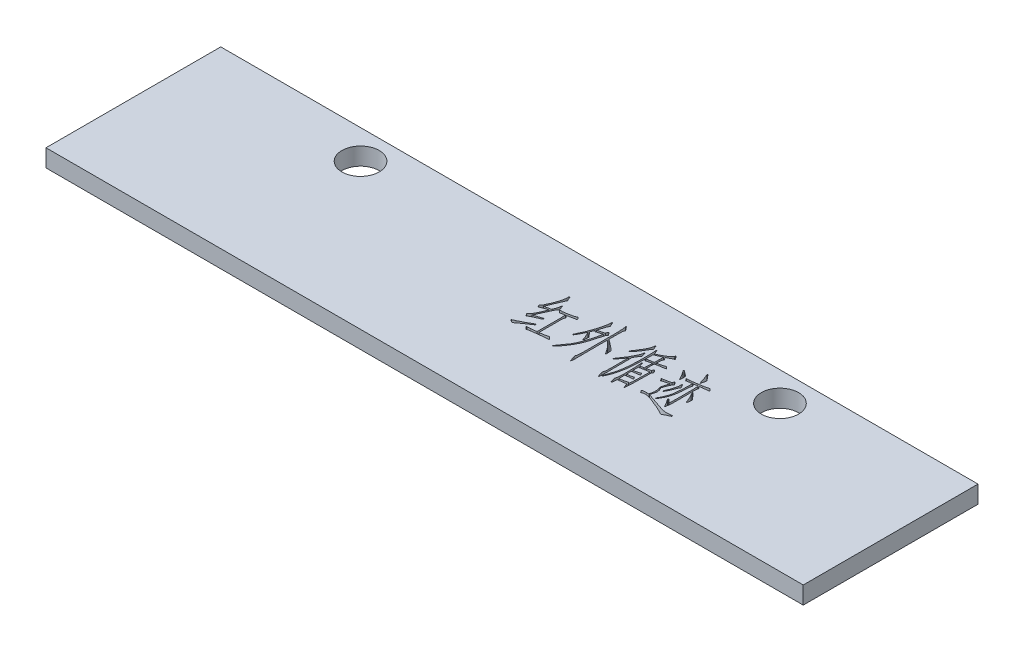
from build123d import *

# Parameters (mm, degrees)
SKETCH_1_W          = 65
SKETCH_1_H          = 15
EXTRUDE_1_DEPTH     = 1.5
SKETCH_2_R          = 1.6
CUT_EXTRUDE_1_DEPTH = 1.5
CUT_EXTRUDE_4_DEPTH = 34.38787205


with BuildPart() as part:
    # 草图1 → 凸台-拉伸1 (new body)
    with BuildSketch(Plane(origin=(0, 0, 0), x_dir=(1, 0, 0), z_dir=(0, 1, 0))):
        Rectangle(SKETCH_1_W, SKETCH_1_H)
    extrude(amount=EXTRUDE_1_DEPTH)

    # 草图2 → 切除-拉伸1 (cut)
    with BuildSketch(Plane(origin=(0, 1.5, 0), x_dir=(1, 0, 0), z_dir=(0, 1, 0))):
        with Locations(Location((-18, 5, 0), (0, 0, 270))):
            Circle(SKETCH_2_R)
    cut_extrude_1 = extrude(amount=-CUT_EXTRUDE_1_DEPTH, mode=Mode.SUBTRACT)

    # 镜向1: 切除-拉伸1 across plane
    add(cut_extrude_1.mirror(Plane.ZY), mode=Mode.SUBTRACT)

    # 草图3 → 切除-拉伸4 (cut, through all)
    # profile 1 of 14: a face of its own
    with BuildSketch(Plane(origin=(0, 1.5, 0), x_dir=(1, 0, 0), z_dir=(0, 1, 0))):
        with BuildLine():
            Line((1.645962071, 0.428084381), (1.676539527, 0.337097805))
            add(Edge.make_bspline(
                [(1.676539527, 0.337097805), (1.636050489, 0.309455775), (1.550005804, 0.250712719), (1.412356524, 0.158244131), (1.259353477, 0.055245984), (1.093645425, -0.053171729), (0.92688686, -0.165569624), (0.768485756, -0.278137619), (0.623169368, -0.38800601), (0.532278634, -0.462366726), (0.488493501, -0.498188792)],
                knots=[0, 0, 0, 0, 0.80976319, 1.720856377, 2.738992834, 3.856216176, 4.991679852, 6.060433679, 7.065645471, 8, 8, 8, 8], degree=3))
            Line((0.488493501, -0.498188792), (0.307266141, -0.387811634))
            add(Edge.make_bspline(
                [(0.307266141, -0.387811634), (0.297794816, -0.381654406), (0.281158653, -0.370839378), (0.260246347, -0.356374902), (0.247282345, -0.345440021), (0.239135861, -0.332994604), (0.246712752, -0.315835642), (0.252830283, -0.304016228), (0.256552312, -0.296825059)],
                knots=[0, 0, 0, 0, 1.610272886, 2.828406944, 3.604818111, 4.048395154, 4.812604234, 6, 6, 6, 6], degree=3))
            Line((0.256552312, -0.296825059), (0.513850416, -0.18122736))
            Line((0.513850416, -0.18122736), (0.991902834, 0.055188579))
            Line((0.991902834, 0.055188579), (1.645962071, 0.428084381))
        make_face()
    # profile 2 of 14: a face of its own
    with BuildSketch(Plane(origin=(0, 1.5, 0), x_dir=(1, 0, 0), z_dir=(0, 1, 0))):
        with BuildLine():
            Line((1.021734498, 3.860963137), (1.077668869, 3.911676966))
            Line((1.077668869, 3.911676966), (1.263370978, 3.494033667))
            add(Edge.make_bspline(
                [(1.263370978, 3.494033667), (1.251134, 3.475430045), (1.228659925, 3.441263179), (1.203295024, 3.401226944), (1.186287609, 3.368858477), (1.172966515, 3.337510388), (1.15222251, 3.293652955), (1.127151716, 3.235733953), (1.095740772, 3.164535291), (1.059471028, 3.079643107), (1.017469332, 2.981443043), (0.955342812, 2.835860996), (0.877680078, 2.652892865), (0.790838123, 2.442550007), (0.711224752, 2.25021254), (0.662380245, 2.127299459), (0.639143405, 2.068825911)],
                knots=[0, 0, 0, 0, 0.600527886, 1.102911902, 1.276808519, 1.585811785, 2.020747077, 2.58497364, 3.287374075, 4.119141018, 5.074132565, 6.167312781, 8.387142202, 10.433689774, 12.30339611, 14, 14, 14, 14], degree=3))
            Line((0.639143405, 2.068825911), (1.218623482, 2.194864692))
            add(Edge.make_bspline(
                [(1.218623482, 2.194864692), (1.239193308, 2.249403961), (1.279352022, 2.355881616), (1.322267498, 2.48780983), (1.352227428, 2.584288879), (1.367460439, 2.643650511), (1.378894292, 2.690255475), (1.382616172, 2.717385168), (1.384189218, 2.728851481)],
                knots=[0, 0, 0, 0, 1.87355048, 3.657754567, 4.45919696, 5.120191514, 5.628150642, 6, 6, 6, 6], degree=3))
            Line((1.384189218, 2.728851481), (1.399850842, 2.869806094))
            Line((1.399850842, 2.869806094), (1.449818879, 2.894417217))
            Line((1.449818879, 2.894417217), (1.581078202, 2.48199446))
            add(Edge.make_bspline(
                [(1.581078202, 2.48199446), (1.565187967, 2.466300394), (1.534366399, 2.435859325), (1.493120467, 2.387837517), (1.4578535, 2.339863944), (1.438835858, 2.306421938), (1.429682506, 2.290326017)],
                knots=[0, 0, 0, 0, 1.092406967, 2.118892347, 3.094606947, 4, 4, 4, 4], degree=3))
            Line((1.429682506, 2.290326017), (1.343916471, 2.11953974))
            Line((1.343916471, 2.11953974), (1.253675687, 1.933091839))
            Line((1.253675687, 1.933091839), (0.805454933, 0.931493714))
            Line((0.805454933, 0.931493714), (1.570637119, 1.188046026))
            Line((1.570637119, 1.188046026), (1.590773492, 1.082143618))
            add(Edge.make_bspline(
                [(1.590773492, 1.082143618), (1.530787392, 1.057461801), (1.415709337, 1.010111907), (1.251898198, 0.93941119), (1.103922818, 0.872599137), (0.970932819, 0.81166694), (0.854557646, 0.752180782), (0.753312558, 0.698272182), (0.667424679, 0.648811553), (0.617338997, 0.614560343), (0.594395909, 0.598870658)],
                knots=[0, 0, 0, 0, 1.403511015, 2.692512342, 3.860204985, 4.916644339, 5.857234213, 6.687504158, 7.398776106, 8, 8, 8, 8], degree=3))
            Line((0.594395909, 0.598870658), (0.498188792, 0.739825272))
            add(Edge.make_bspline(
                [(0.498188792, 0.739825272), (0.492355102, 0.747687564), (0.481545223, 0.76225646), (0.468431069, 0.783430463), (0.461338267, 0.802633349), (0.458603494, 0.820629916), (0.466095562, 0.838164974), (0.481633838, 0.854432005), (0.503984489, 0.872456976), (0.545644199, 0.894463174), (0.597428896, 0.927167239), (0.637435664, 0.967609535), (0.660035887, 1.000522365), (0.674603531, 1.024371817), (0.692801433, 1.054141901), (0.712675411, 1.090991075), (0.735623175, 1.134085622), (0.762048529, 1.183263174), (0.789974612, 1.239291997), (0.809903224, 1.278549105), (0.820370765, 1.299168975)],
                knots=[0, 0, 0, 0, 0.752216787, 1.3938643, 1.901041409, 2.322706069, 2.751652425, 3.306515275, 4.039846997, 4.946671138, 6.916053873, 8.724874332, 9.259675223, 9.979973354, 10.870376609, 11.938273844, 13.193581997, 14.619561571, 16.224418362, 18, 18, 18, 18], degree=3))
            Line((0.820370765, 1.299168975), (0.921052632, 1.500532708))
            Line((0.921052632, 1.500532708), (1.052311954, 1.81749414))
            Line((1.052311954, 1.81749414), (1.152993821, 2.044214788))
            add(Edge.make_bspline(
                [(1.152993821, 2.044214788), (1.112665265, 2.032718049), (1.034755026, 2.01050764), (0.923420103, 1.975490496), (0.821342434, 1.941271746), (0.729161173, 1.906971601), (0.646075669, 1.873738097), (0.572853463, 1.840246635), (0.509224802, 1.807055882), (0.471207842, 1.783165565), (0.453441296, 1.772000852)],
                knots=[0, 0, 0, 0, 1.33625665, 2.58149771, 3.71882619, 4.766547028, 5.715383262, 6.569656955, 7.331554746, 8, 8, 8, 8], degree=3))
            Line((0.453441296, 1.772000852), (0.372895802, 1.918176007))
            add(Edge.make_bspline(
                [(0.372895802, 1.918176007), (0.366031525, 1.927329549), (0.353439655, 1.944120859), (0.348953375, 1.972435606), (0.359580609, 1.993805257), (0.373877444, 2.0138374), (0.397008389, 2.036604019), (0.435506579, 2.070480806), (0.48270744, 2.112637867), (0.519787197, 2.163437272), (0.543615357, 2.210436486), (0.567912859, 2.257333117), (0.596380248, 2.31867195), (0.643341547, 2.417654609), (0.702898495, 2.54986866), (0.762327733, 2.684903173), (0.807816025, 2.796511088), (0.839939217, 2.888381703), (0.873558108, 2.987697018), (0.903052396, 3.093189798), (0.932312038, 3.197795387), (0.958671404, 3.295878069), (0.979956763, 3.385093), (0.999173957, 3.464903856), (1.013571444, 3.535993754), (1.022584061, 3.598489609), (1.027778335, 3.652053991), (1.027211985, 3.684948374), (1.026955039, 3.69987215)],
                knots=[0, 0, 0, 0, 0.456681616, 0.837739317, 1.065589596, 1.394840945, 1.825057879, 2.361735632, 3.454967656, 4.354616771, 4.863226297, 5.567911411, 6.473455592, 7.575386491, 9.963122703, 12.290106264, 13.493836545, 14.79660568, 16.193678832, 17.69916562, 19.189614258, 20.551504439, 21.772991567, 22.868813277, 23.844766624, 24.681110003, 25.401635851, 26, 26, 26, 26], degree=3))
            Line((1.026955039, 3.69987215), (1.021734498, 3.860963137))
        make_face()
    # profile 3 of 14: a face of its own
    with BuildSketch(Plane(origin=(0, 1.5, 0), x_dir=(1, 0, 0), z_dir=(0, 1, 0))):
        with BuildLine():
            Line((2.24035798, -0.090240784), (2.245578521, 1.958448753))
            add(Edge.make_bspline(
                [(2.245578521, 1.958448753), (2.245022953, 1.985057114), (2.243781024, 2.044538052), (2.237164167, 2.140476603), (2.229501443, 2.24658728), (2.219841158, 2.31944951), (2.215001065, 2.355955679)],
                knots=[0, 0, 0, 0, 0.800507137, 1.789472022, 2.892458984, 4, 4, 4, 4], degree=3))
            add(Edge.make_bspline(
                [(2.215001065, 2.355955679), (2.147499329, 2.343264017), (2.014533976, 2.3182639), (1.885997703, 2.276054845), (1.822714681, 2.255273812)],
                knots=[0, 0, 0, 0, 1.015328195, 2, 2, 2, 2], degree=3))
            Line((1.822714681, 2.255273812), (1.666098444, 2.401448967))
            add(Edge.make_bspline(
                [(1.666098444, 2.401448967), (1.660883246, 2.407742626), (1.649300324, 2.421720804), (1.643446299, 2.449153994), (1.662745141, 2.473101448), (1.700654972, 2.477609662), (1.754138482, 2.483876618), (1.797467873, 2.482687389), (1.822714681, 2.48199446)],
                knots=[0, 0, 0, 0, 0.619214323, 1.375271128, 1.870429507, 2.748938185, 4.105698436, 6, 6, 6, 6], degree=3))
            add(Edge.make_bspline(
                [(1.822714681, 2.48199446), (1.831669769, 2.481844022), (1.853102215, 2.481483974), (1.890628164, 2.485397398), (1.938925596, 2.490200511), (1.997762896, 2.49893777), (2.067436255, 2.509177732), (2.147972516, 2.522739617), (2.239369367, 2.539381079), (2.338760874, 2.556985541), (2.438894571, 2.577453638), (2.533882194, 2.597768136), (2.619665128, 2.620149025), (2.696593902, 2.64357093), (2.765496064, 2.665926764), (2.825123241, 2.690719175), (2.87642288, 2.715448852), (2.906017303, 2.734780901), (2.919774132, 2.743767313)],
                knots=[0, 0, 0, 0, 0.378203417, 0.905164163, 1.59197985, 2.429933081, 3.417967026, 4.568227812, 5.880929752, 7.343971244, 8.833589499, 10.199849241, 11.448431545, 12.578460643, 13.598374815, 14.50752339, 15.306229242, 16, 16, 16, 16], degree=3))
            Line((2.919774132, 2.743767313), (3.051033454, 2.597592159))
            add(Edge.make_bspline(
                [(3.051033454, 2.597592159), (3.060106833, 2.586740093), (3.074544995, 2.569471565), (3.089346631, 2.541802635), (3.080021542, 2.517685941), (3.067906069, 2.507917658), (3.060728745, 2.502130833)],
                knots=[0, 0, 0, 0, 1.500894392, 2.388322783, 3.04522675, 4, 4, 4, 4], degree=3))
            Line((3.060728745, 2.502130833), (2.884721926, 2.48199446))
            Line((2.884721926, 2.48199446), (2.326124014, 2.370871511))
            Line((2.326124014, 2.370871511), (2.451417004, 2.165033028))
            add(Edge.make_bspline(
                [(2.451417004, 2.165033028), (2.445292949, 2.140151526), (2.433894924, 2.093842341), (2.416542256, 2.029052711), (2.403715214, 1.970597004), (2.394049641, 1.922446994), (2.390498998, 1.877197791), (2.388404316, 1.829698903), (2.387032969, 1.768029523), (2.386710764, 1.722033251), (2.386533134, 1.6966759)],
                knots=[0, 0, 0, 0, 1.294230999, 2.408808923, 3.386637512, 4.317637544, 4.884880133, 5.676797227, 6.719238186, 8, 8, 8, 8], degree=3))
            Line((2.386533134, 1.6966759), (2.386533134, -0.075324952))
            add(Edge.make_bspline(
                [(2.386533134, -0.075324952), (2.421583804, -0.070342206), (2.488448151, -0.06083688), (2.58342558, -0.047505898), (2.668238202, -0.035611086), (2.742361151, -0.024658322), (2.805940084, -0.014054637), (2.859108366, -0.004938204), (2.90201213, 0.002012123), (2.963361417, 0.014861821), (3.045253864, 0.039349105), (3.11275993, 0.070299283), (3.146494779, 0.085766035)],
                knots=[0, 0, 0, 0, 1.361035419, 2.596376767, 3.687097605, 4.653496452, 5.476792367, 6.164967737, 6.727456286, 7.147315221, 8.574426045, 10, 10, 10, 10], degree=3))
            Line((3.146494779, 0.085766035), (3.307585766, -0.070104411))
            add(Edge.make_bspline(
                [(3.307585766, -0.070104411), (3.317238973, -0.081713401), (3.333665549, -0.101468076), (3.340677274, -0.132917114), (3.332954599, -0.151501721), (3.321019548, -0.161345613), (3.303138113, -0.165770208), (3.289697478, -0.166118173), (3.282228851, -0.166311528)],
                knots=[0, 0, 0, 0, 1.880683592, 3.200303609, 3.743507111, 4.317031777, 5.064816454, 6, 6, 6, 6], degree=3))
            Line((3.282228851, -0.166311528), (3.176326444, -0.170786277))
            Line((3.176326444, -0.170786277), (3.030897081, -0.18122736))
            add(Edge.make_bspline(
                [(3.030897081, -0.18122736), (2.969489399, -0.187648282), (2.840913922, -0.201092417), (2.639926597, -0.22299336), (2.422798461, -0.250604427), (2.234052441, -0.274254344), (2.08318145, -0.294631014), (1.979021134, -0.309591385), (1.885807439, -0.323835856), (1.803380076, -0.336729998), (1.732095428, -0.35039894), (1.671925557, -0.363011816), (1.622377167, -0.374215412), (1.593705756, -0.383654459), (1.581078202, -0.387811634)],
                knots=[0, 0, 0, 0, 1.516467517, 3.175181509, 4.965517206, 6.892178622, 7.847225773, 8.704673777, 9.476666545, 10.163264877, 10.753637089, 11.258982834, 11.673638855, 12, 12, 12, 12], degree=3))
            Line((1.581078202, -0.387811634), (1.460259962, -0.251331771))
            add(Edge.make_bspline(
                [(1.460259962, -0.251331771), (1.453475922, -0.244717254), (1.441527266, -0.233067179), (1.426851887, -0.216727616), (1.41868667, -0.204290736), (1.412555932, -0.191891337), (1.423027496, -0.176979908), (1.433649998, -0.170351207), (1.440123588, -0.166311528)],
                knots=[0, 0, 0, 0, 1.519942899, 2.677058809, 3.483068826, 3.948986081, 4.750066327, 6, 6, 6, 6], degree=3))
            Line((1.440123588, -0.166311528), (1.722032815, -0.146175154))
            Line((1.722032815, -0.146175154), (2.24035798, -0.090240784))
        make_face()
    # profile 4 of 14: a face of its own
    with BuildSketch(Plane(origin=(0, 1.5, 0), x_dir=(1, 0, 0), z_dir=(0, 1, 0))):
        with BuildLine():
            add(Edge.make_bspline(
                [(3.949712338, -0.448220754), (3.993264433, -0.392510706), (4.082141104, -0.278823329), (4.212285656, -0.10083347), (4.34728556, 0.083979907), (4.482690945, 0.276986918), (4.613652834, 0.479109264), (4.728736527, 0.693548314), (4.830123034, 0.91725253), (4.913959214, 1.147507587), (4.987176956, 1.373420937), (5.052917249, 1.586366681), (5.110734237, 1.782355921), (5.159413985, 1.962717202), (5.200239466, 2.128535664), (5.236745926, 2.280671601), (5.265777871, 2.420507137), (5.281640269, 2.509801439), (5.289154059, 2.552098871)],
                knots=[0, 0, 0, 0, 1.019443893, 2.080377014, 3.178695844, 4.319137773, 5.479456721, 6.648538662, 7.824369872, 9.01741333, 10.179170645, 11.248239649, 12.230441095, 13.125087289, 13.941345873, 14.692480095, 15.380646556, 16, 16, 16, 16], degree=3))
            Line((5.289154059, 2.552098871), (5.192946942, 2.527487748))
            Line((5.192946942, 2.527487748), (5.062433411, 2.491689751))
            Line((5.062433411, 2.491689751), (4.901342425, 2.446942254))
            Line((4.901342425, 2.446942254), (4.749946729, 2.391007884))
            add(Edge.make_bspline(
                [(4.749946729, 2.391007884), (4.745390647, 2.394903321), (4.732664661, 2.405784002), (4.721842316, 2.418586718), (4.714894524, 2.426805881)],
                knots=[0, 0, 0, 0, 0.716028134, 2, 2, 2, 2], degree=3))
            Line((4.714894524, 2.426805881), (4.654485404, 2.487215001))
            Line((4.654485404, 2.487215001), (4.513530791, 2.134455572))
            Line((4.513530791, 2.134455572), (4.594076284, 2.048689538))
            Line((4.594076284, 2.048689538), (4.720115065, 1.907734924))
            Line((4.720115065, 1.907734924), (4.820796932, 1.797357767))
            add(Edge.make_bspline(
                [(4.820796932, 1.797357767), (4.829867908, 1.786260688), (4.845801831, 1.766767748), (4.864831124, 1.740652359), (4.877812026, 1.723064919), (4.884929006, 1.707164081), (4.886912486, 1.686227762), (4.88872463, 1.659677856), (4.889842377, 1.634769327), (4.890647161, 1.620604277), (4.890901342, 1.616130407)],
                knots=[0, 0, 0, 0, 1.702417513, 2.990437787, 3.84254316, 4.292504947, 5.040434433, 6.313804086, 7.467434142, 8, 8, 8, 8], degree=3))
            Line((4.890901342, 1.616130407), (4.881206052, 1.51544854))
            Line((4.881206052, 1.51544854), (4.866290219, 1.409546133))
            Line((4.866290219, 1.409546133), (4.850628596, 1.319305348))
            add(Edge.make_bspline(
                [(4.850628596, 1.319305348), (4.849056268, 1.312302768), (4.846259701, 1.299847868), (4.840636901, 1.284402646), (4.834854348, 1.274179388), (4.826897476, 1.268763107), (4.817677393, 1.272316377), (4.810850784, 1.281750223), (4.802121083, 1.295416618), (4.797893087, 1.307230456), (4.795440017, 1.314084807)],
                knots=[0, 0, 0, 0, 1.522967193, 2.708773447, 3.469799833, 4.013076409, 4.563987221, 5.348435265, 6.461570815, 8, 8, 8, 8], degree=3))
            Line((4.795440017, 1.314084807), (4.775303644, 1.369273386))
            Line((4.775303644, 1.369273386), (4.705199233, 1.57585766))
            add(Edge.make_bspline(
                [(4.705199233, 1.57585766), (4.70071375, 1.584552907), (4.689092731, 1.607080607), (4.667930718, 1.649092591), (4.640923782, 1.707801509), (4.608303295, 1.778738336), (4.573778589, 1.853697836), (4.54032909, 1.924725858), (4.509189354, 1.987493902), (4.488275556, 2.02612039), (4.478478585, 2.044214788)],
                knots=[0, 0, 0, 0, 0.451183024, 1.168927857, 2.168972459, 3.430819384, 4.769529243, 5.974587881, 7.051205131, 8, 8, 8, 8], degree=3))
            add(Edge.make_bspline(
                [(4.478478585, 2.044214788), (4.465325439, 2.016609857), (4.436724694, 1.956584552), (4.389816408, 1.859468175), (4.334280165, 1.748639645), (4.274457946, 1.627388305), (4.210827372, 1.506284247), (4.148720879, 1.392857841), (4.086903617, 1.293167359), (4.044888393, 1.231906177), (4.02503729, 1.202961858)],
                knots=[0, 0, 0, 0, 0.767037816, 1.667878789, 2.70530405, 3.876586402, 5.059234279, 6.136742012, 7.119658934, 8, 8, 8, 8], degree=3))
            Line((4.02503729, 1.202961858), (3.984764543, 1.268591519))
            add(Edge.make_bspline(
                [(3.984764543, 1.268591519), (4.036288027, 1.365765431), (4.136860261, 1.555445873), (4.26767479, 1.844764041), (4.385214292, 2.132834435), (4.46094237, 2.351674134), (4.509350317, 2.495490295), (4.530129246, 2.561563867), (4.549084963, 2.621617852), (4.567762271, 2.675400547), (4.582245202, 2.724174707), (4.5956301, 2.766866939), (4.607102921, 2.803824446), (4.619597954, 2.847816687), (4.634836386, 2.905789665), (4.655301618, 2.983898705), (4.676614227, 3.076776681), (4.699140517, 3.179025072), (4.721667871, 3.280517128), (4.739370637, 3.37136302), (4.753064529, 3.446395871), (4.762754626, 3.507285887), (4.7673185, 3.557207304), (4.772506476, 3.598358616), (4.774642473, 3.632725754), (4.775545946, 3.666554619), (4.775266377, 3.696640717), (4.775293598, 3.71752264), (4.775303644, 3.725229065)],
                knots=[0, 0, 0, 0, 3.300144533, 6.441779117, 9.524390124, 12.634470094, 13.389447811, 14.078429614, 14.713122224, 15.279355512, 15.786743317, 16.239828241, 16.622152201, 16.948043932, 17.612220869, 18.421087648, 19.371187858, 20.471747546, 21.563420345, 22.491080495, 23.249148476, 23.852688118, 24.340442764, 24.753220077, 25.09714498, 25.373294593, 25.768715862, 26, 26, 26, 26], degree=3))
            Line((4.775303644, 3.725229065), (4.775303644, 3.825910931))
            Line((4.775303644, 3.825910931), (4.81557639, 3.851267846))
            Line((4.81557639, 3.851267846), (5.007244833, 3.413488174))
            add(Edge.make_bspline(
                [(5.007244833, 3.413488174), (4.992829623, 3.397984981), (4.963931593, 3.366905881), (4.933579251, 3.319302044), (4.911056504, 3.269254841), (4.890864895, 3.212889859), (4.865391844, 3.138091711), (4.83649503, 3.046202545), (4.804696382, 2.941229631), (4.768497931, 2.828071184), (4.730796694, 2.707483333), (4.703578089, 2.625148191), (4.689537609, 2.582676326)],
                knots=[0, 0, 0, 0, 0.707951741, 1.419224008, 1.877391299, 2.543844382, 3.423127426, 4.523641151, 5.769167716, 7.096133381, 8.50206576, 10, 10, 10, 10], degree=3))
            Line((4.689537609, 2.582676326), (4.770083102, 2.592371617))
            Line((4.770083102, 2.592371617), (4.916258257, 2.628169614))
            Line((4.916258257, 2.628169614), (5.102706158, 2.672917111))
            Line((5.102706158, 2.672917111), (5.208608566, 2.703494566))
            Line((5.208608566, 2.703494566), (5.278712977, 2.733326231))
            Line((5.278712977, 2.733326231), (5.349563179, 2.879501385))
            add(Edge.make_bspline(
                [(5.349563179, 2.879501385), (5.353918136, 2.887543034), (5.361530143, 2.901598994), (5.372641302, 2.918518133), (5.380595679, 2.929561179), (5.393022765, 2.934743999), (5.409842979, 2.918567261), (5.422060419, 2.907155361), (5.430108672, 2.899637758)],
                knots=[0, 0, 0, 0, 1.365828608, 2.387325223, 3.045473013, 3.363316041, 4.263081241, 6, 6, 6, 6], degree=3))
            Line((5.430108672, 2.899637758), (5.565842745, 2.713189857))
            add(Edge.make_bspline(
                [(5.565842745, 2.713189857), (5.570993121, 2.705032943), (5.579282548, 2.691904556), (5.588628637, 2.671021134), (5.57843635, 2.650353024), (5.567564403, 2.639545455), (5.560622203, 2.632644364)],
                knots=[0, 0, 0, 0, 1.2556588, 2.020957134, 2.736297179, 4, 4, 4, 4], degree=3))
            add(Edge.make_bspline(
                [(5.560622203, 2.632644364), (5.551868956, 2.624245483), (5.53385513, 2.606960929), (5.507941083, 2.58012886), (5.483297449, 2.553751162), (5.467243186, 2.530596261), (5.458517303, 2.508579116), (5.451177293, 2.484893121), (5.441803468, 2.450236591), (5.429939208, 2.40441177), (5.414828861, 2.347846068), (5.397782686, 2.279948297), (5.37853418, 2.200798147), (5.348203824, 2.078298947), (5.305111867, 1.911520243), (5.244689096, 1.70056517), (5.174096041, 1.476918574), (5.0955374, 1.240872203), (5.002217765, 0.995813227), (4.884434655, 0.747340243), (4.747227174, 0.494504239), (4.617498326, 0.285174087), (4.507093469, 0.121537307), (4.426622933, 0.004517197), (4.34782519, -0.103737279), (4.271750348, -0.204355619), (4.197163236, -0.295963586), (4.124859031, -0.379589909), (4.055004454, -0.455277268), (4.007584338, -0.501366411), (3.984764543, -0.523545706)],
                knots=[0, 0, 0, 0, 0.284581823, 0.585657774, 0.87480458, 1.132014233, 1.239236703, 1.42920676, 1.713609244, 2.081403765, 2.539736739, 3.087150127, 3.723681483, 4.450735938, 6.04778241, 7.764550939, 9.598068358, 11.549333254, 13.600661354, 15.745309023, 17.994857511, 20.346538357, 21.519261357, 22.625830895, 23.678074508, 24.660230732, 25.584748076, 26.448868756, 27.253555255, 28, 28, 28, 28], degree=3))
            Line((3.984764543, -0.523545706), (3.949712338, -0.448220754))
        make_face()
    # profile 5 of 14: a face of its own
    with BuildSketch(Plane(origin=(0, 1.5, 0), x_dir=(1, 0, 0), z_dir=(0, 1, 0))):
        with BuildLine():
            Line((5.716492649, 4.107820158), (5.973790752, 3.770722352))
            add(Edge.make_bspline(
                [(5.973790752, 3.770722352), (5.961835664, 3.744102588), (5.939764812, 3.694958583), (5.918544709, 3.629767236), (5.909531261, 3.569841726), (5.906192717, 3.506006418), (5.902928799, 3.421227871), (5.902936347, 3.357808225), (5.90294055, 3.322501598)],
                knots=[0, 0, 0, 0, 1.143938929, 2.111879707, 2.674221482, 3.514321669, 4.616187198, 6, 6, 6, 6], degree=3))
            Line((5.90294055, 3.322501598), (5.897720009, 3.09578095))
            Line((5.897720009, 3.09578095), (5.893245259, 2.42158534))
            Line((5.893245259, 2.42158534), (6.028979331, 2.326124014))
            Line((6.028979331, 2.326124014), (6.20498615, 2.189644151))
            Line((6.20498615, 2.189644151), (6.431706797, 2.013637332))
            Line((6.431706797, 2.013637332), (6.642765821, 1.842851055))
            Line((6.642765821, 1.842851055), (6.768804603, 1.742169188))
            add(Edge.make_bspline(
                [(6.768804603, 1.742169188), (6.776603337, 1.735811186), (6.790536928, 1.724451676), (6.808326222, 1.707589844), (6.821229711, 1.693099097), (6.82975507, 1.678872786), (6.835188715, 1.662837625), (6.840550118, 1.642471892), (6.844258825, 1.61585479), (6.847555961, 1.596231148), (6.849350096, 1.585552951)],
                knots=[0, 0, 0, 0, 1.313295204, 2.346396107, 3.198411869, 3.838607667, 4.495856686, 5.401230266, 6.585880463, 8, 8, 8, 8], degree=3))
            Line((6.849350096, 1.585552951), (6.864265928, 1.434903047))
            Line((6.864265928, 1.434903047), (6.864265928, 1.319305348))
            Line((6.864265928, 1.319305348), (6.864265928, 1.228318773))
            add(Edge.make_bspline(
                [(6.864265928, 1.228318773), (6.862447185, 1.218690292), (6.859372499, 1.202412817), (6.848251041, 1.181106367), (6.825368721, 1.180960518), (6.821783553, 1.194443358), (6.819518432, 1.202961858)],
                knots=[0, 0, 0, 0, 1.377038327, 2.327958954, 2.943599232, 4, 4, 4, 4], degree=3))
            Line((6.819518432, 1.202961858), (6.799382058, 1.238759855))
            add(Edge.make_bspline(
                [(6.799382058, 1.238759855), (6.796426887, 1.243749011), (6.788797462, 1.256629614), (6.774045014, 1.279213378), (6.753447749, 1.309231211), (6.728480497, 1.347450522), (6.696686363, 1.392703356), (6.660732418, 1.446306331), (6.618406674, 1.507000162), (6.571234469, 1.57543139), (6.517298779, 1.650282103), (6.453280843, 1.728474691), (6.381099411, 1.811004936), (6.300381098, 1.897427003), (6.211281494, 1.988129006), (6.112955055, 2.082259893), (6.006358746, 2.180802394), (5.931664831, 2.246723525), (5.893245259, 2.280630727)],
                knots=[0, 0, 0, 0, 0.200646886, 0.518014083, 0.933176201, 1.460471102, 2.097591177, 2.8468136, 3.69394674, 4.658059418, 5.723158196, 6.885314141, 8.153441398, 9.516902622, 10.97687385, 12.552664983, 14.226828324, 16, 16, 16, 16], degree=3))
            Line((5.893245259, 2.280630727), (5.888024718, 1.666098444))
            Line((5.888024718, 1.666098444), (5.897720009, 0))
            Line((5.897720009, 0), (5.90294055, -0.417643299))
            Line((5.90294055, -0.417643299), (5.897720009, -0.583954826))
            Line((5.897720009, -0.583954826), (5.888024718, -0.694331984))
            add(Edge.make_bspline(
                [(5.888024718, -0.694331984), (5.886168143, -0.714202012), (5.882620539, -0.752170325), (5.873736568, -0.786691172), (5.865885775, -0.822232471), (5.845882768, -0.810926362), (5.837028598, -0.785702005), (5.828043747, -0.763944864), (5.822395056, -0.750266354)],
                knots=[0, 0, 0, 0, 1.661526053, 3.174899314, 3.654141369, 3.980589294, 4.730415523, 6, 6, 6, 6], degree=3))
            Line((5.822395056, -0.750266354), (5.78212231, -0.639143405))
            Line((5.78212231, -0.639143405), (5.726933731, -0.468357128))
            Line((5.726933731, -0.468357128), (5.676219902, -0.291604517))
            add(Edge.make_bspline(
                [(5.676219902, -0.291604517), (5.673622507, -0.283017269), (5.669226848, -0.268484777), (5.667298167, -0.245517574), (5.677185971, -0.221879022), (5.689872844, -0.191587692), (5.705345384, -0.154579538), (5.715762816, -0.118696078), (5.722504578, -0.084160736), (5.727663954, -0.048590926), (5.73156301, -0.003469977), (5.736912524, 0.047434677), (5.740453298, 0.097482475), (5.744941695, 0.139153615), (5.746178423, 0.169291168), (5.746822465, 0.185453774), (5.747070104, 0.191668442)],
                knots=[0, 0, 0, 0, 0.763279694, 1.291724078, 1.912907954, 2.897467491, 4.101543217, 5.311347828, 6.065218476, 7.089744711, 8.36331834, 9.912215271, 11.438190107, 12.625664814, 13.471555616, 14, 14, 14, 14], degree=3))
            Line((5.747070104, 0.191668442), (5.747070104, 0.488493501))
            Line((5.747070104, 0.488493501), (5.747070104, 1.500532708))
            Line((5.747070104, 1.500532708), (5.747070104, 2.980183252))
            Line((5.747070104, 2.980183252), (5.741849563, 3.417962924))
            add(Edge.make_bspline(
                [(5.741849563, 3.417962924), (5.74032011, 3.450278812), (5.737473063, 3.510434176), (5.734066366, 3.593989789), (5.730102213, 3.664072442), (5.727117023, 3.722252159), (5.724482152, 3.770787019), (5.720220061, 3.812228321), (5.717448762, 3.847744516), (5.711030227, 3.87961537), (5.704770233, 3.91400327), (5.695616915, 3.955930936), (5.684438506, 4.008383671), (5.67622516, 4.046666091), (5.671745152, 4.067547411)],
                knots=[0, 0, 0, 0, 1.778204637, 3.310091456, 4.59631864, 5.63621628, 6.512415514, 7.267031907, 7.926450306, 8.467860143, 9.052063989, 9.847981841, 10.826171913, 12, 12, 12, 12], degree=3))
            Line((5.671745152, 4.067547411), (5.716492649, 4.107820158))
        make_face()
    # profile 6 of 14: a face of its own
    with BuildSketch(Plane(origin=(0, 1.5, 0), x_dir=(1, 0, 0), z_dir=(0, 1, 0))):
        with BuildLine():
            Line((8.428190923, 2.910078841), (8.47815896, 2.930215214))
            Line((8.47815896, 2.930215214), (8.584061368, 2.54240358))
            add(Edge.make_bspline(
                [(8.584061368, 2.54240358), (8.562256448, 2.52566256), (8.520448786, 2.493564166), (8.488817905, 2.451436485), (8.473684211, 2.431280631)],
                knots=[0, 0, 0, 0, 1.04310639, 2, 2, 2, 2], degree=3))
            Line((8.473684211, 2.431280631), (8.352865971, 2.24035798))
            Line((8.352865971, 2.24035798), (8.246963563, 2.064351161))
            Line((8.246963563, 2.064351161), (8.261879395, -0.150649904))
            Line((8.261879395, -0.150649904), (8.256658854, -0.448220754))
            Line((8.256658854, -0.448220754), (8.246963563, -0.593650117))
            Line((8.246963563, -0.593650117), (8.246963563, -0.679416152))
            add(Edge.make_bspline(
                [(8.246963563, -0.679416152), (8.246102837, -0.690673009), (8.244573502, -0.710674167), (8.237706111, -0.736462674), (8.229861901, -0.755442145), (8.217685187, -0.766030631), (8.204305997, -0.768007271), (8.192115074, -0.761283025), (8.183000102, -0.747724934), (8.178587452, -0.736451043), (8.17611336, -0.730129981)],
                knots=[0, 0, 0, 0, 1.74999307, 3.109383625, 4.146495594, 4.888954774, 5.512181505, 6.117163487, 6.944328464, 8, 8, 8, 8], degree=3))
            Line((8.17611336, -0.730129981), (8.135840614, -0.619007032))
            Line((8.135840614, -0.619007032), (8.060515662, -0.377370552))
            add(Edge.make_bspline(
                [(8.060515662, -0.377370552), (8.05536797, -0.364435109), (8.046716039, -0.342693993), (8.040622932, -0.314038602), (8.046097613, -0.293485033), (8.051262585, -0.273889291), (8.058851545, -0.248534917), (8.071752262, -0.206939477), (8.089565891, -0.15185322), (8.101431273, -0.081802861), (8.110665633, -0.008899597), (8.11541587, 0.058117193), (8.118424956, 0.123528749), (8.119417738, 0.190177979), (8.121433055, 0.273447181), (8.121104479, 0.334361376), (8.120924782, 0.367675261)],
                knots=[0, 0, 0, 0, 0.777364049, 1.306546848, 1.574627515, 1.946388512, 2.435704764, 3.042735593, 4.366538868, 5.644698896, 6.980472156, 8.448161167, 9.374147435, 10.617071329, 12.149881187, 14, 14, 14, 14], degree=3))
            Line((8.120924782, 0.367675261), (8.120924782, 1.857766887))
            add(Edge.make_bspline(
                [(8.120924782, 1.857766887), (8.093069789, 1.820735055), (8.039601352, 1.749651418), (7.963072285, 1.647509403), (7.892863723, 1.555297999), (7.82996852, 1.471829025), (7.773476451, 1.397983406), (7.724539633, 1.332496399), (7.680926437, 1.277719709), (7.654767568, 1.243760858), (7.642872363, 1.228318773)],
                knots=[0, 0, 0, 0, 1.407007995, 2.700791233, 3.875325629, 4.926061785, 5.874150236, 6.698439419, 7.408142253, 8, 8, 8, 8], degree=3))
            Line((7.642872363, 1.228318773), (7.557106329, 1.117941615))
            Line((7.557106329, 1.117941615), (7.507138291, 1.193266567))
            Line((7.507138291, 1.193266567), (7.592158534, 1.303643725))
            add(Edge.make_bspline(
                [(7.592158534, 1.303643725), (7.625074447, 1.34956182), (7.689208368, 1.439029414), (7.781107259, 1.570775684), (7.865192915, 1.697292267), (7.943803877, 1.816865258), (8.014545624, 1.930838661), (8.078172629, 2.038909614), (8.135887887, 2.140449765), (8.185374798, 2.23671921), (8.229335557, 2.325372981), (8.268014123, 2.406091578), (8.302364217, 2.478050621), (8.331424842, 2.541460363), (8.355784855, 2.596206055), (8.374308321, 2.642781807), (8.387845016, 2.680895863), (8.404967369, 2.735884097), (8.419076629, 2.811517611), (8.425198156, 2.877715302), (8.428190923, 2.910078841)],
                knots=[0, 0, 0, 0, 1.668656827, 3.251239207, 4.743926286, 6.155227724, 7.477546995, 8.705304, 9.859200788, 10.926499092, 11.901735666, 12.781840144, 13.570076638, 14.256735149, 14.841963691, 15.339622352, 15.736721546, 16.036322499, 17.039973269, 18, 18, 18, 18], degree=3))
        make_face()
    # profile 7 of 14: a face of its own
    with BuildSketch(Plane(origin=(0, 1.5, 0), x_dir=(1, 0, 0), z_dir=(0, 1, 0))):
        with BuildLine():
            Line((7.637651822, 2.436501172), (7.758470062, 2.597592159))
            add(Edge.make_bspline(
                [(7.758470062, 2.597592159), (7.764206715, 2.60578286), (7.777538274, 2.624817449), (7.79979964, 2.657709949), (7.827661467, 2.698639456), (7.859331305, 2.748626858), (7.896159987, 2.806871538), (7.936826669, 2.874116316), (7.983090324, 2.949425365), (8.033364177, 3.030228349), (8.082335309, 3.11267613), (8.127876104, 3.190961496), (8.168469507, 3.262642998), (8.203174497, 3.327980293), (8.233395916, 3.38645841), (8.258452196, 3.438419126), (8.276679881, 3.484595636), (8.295252872, 3.534855231), (8.311644266, 3.588274056), (8.326910404, 3.642963282), (8.339679398, 3.68514375), (8.347006426, 3.720187118), (8.353844502, 3.755182794), (8.360109679, 3.798563152), (8.368447098, 3.853727998), (8.374278051, 3.894518544), (8.377477094, 3.916897507)],
                knots=[0, 0, 0, 0, 0.488553412, 1.135362191, 1.940467737, 2.907406364, 4.026196723, 5.307266549, 6.746673727, 8.344422873, 9.956648218, 11.431539155, 12.769332382, 13.981045457, 15.045719021, 15.985658624, 16.797606163, 17.470022152, 18.603223754, 19.525817909, 20.244880679, 20.754711098, 21.274002208, 21.986883808, 22.895541789, 24, 24, 24, 24], degree=3))
            Line((8.377477094, 3.916897507), (8.41774984, 3.946729171))
            Line((8.41774984, 3.946729171), (8.563924995, 3.569358619))
            add(Edge.make_bspline(
                [(8.563924995, 3.569358619), (8.550476803, 3.558477125), (8.526366251, 3.538968268), (8.491317185, 3.509530757), (8.462303864, 3.47017788), (8.444058016, 3.440500423), (8.433411464, 3.423183465)],
                knots=[0, 0, 0, 0, 1.050897794, 1.88409922, 2.765360311, 4, 4, 4, 4], degree=3))
            Line((8.433411464, 3.423183465), (8.342424888, 3.267313019))
            add(Edge.make_bspline(
                [(8.342424888, 3.267313019), (8.327114222, 3.240902314), (8.293776763, 3.183395617), (8.237221167, 3.091293493), (8.167069514, 2.988356059), (8.090209543, 2.875504044), (8.009210035, 2.761450392), (7.928075761, 2.654503177), (7.850401359, 2.556873454), (7.798420686, 2.496267503), (7.773385894, 2.467078628)],
                knots=[0, 0, 0, 0, 0.74514418, 1.622477712, 2.637290371, 3.785153626, 4.955380987, 6.051257577, 7.061451889, 8, 8, 8, 8], degree=3))
            Line((7.773385894, 2.467078628), (7.68314511, 2.36117622))
            Line((7.68314511, 2.36117622), (7.637651822, 2.436501172))
        make_face()
    # profile 8 of 14: a face of its own
    with BuildSketch(Plane(origin=(0, 1.5, 0), x_dir=(1, 0, 0), z_dir=(0, 1, 0))):
        with BuildLine():
            Line((8.745152355, 3.604410825), (8.800340933, 3.63946303))
            Line((8.800340933, 3.63946303), (8.941295547, 3.27700831))
            add(Edge.make_bspline(
                [(8.941295547, 3.27700831), (8.993091047, 3.300937811), (9.092325536, 3.346784107), (9.233279732, 3.415454725), (9.360089392, 3.479899853), (9.472304815, 3.541416007), (9.570751043, 3.598140675), (9.654234795, 3.651829257), (9.724044473, 3.700885128), (9.779506944, 3.747767104), (9.825363908, 3.79078588), (9.864316127, 3.829647236), (9.899381416, 3.863285323), (9.926511345, 3.895030405), (9.949339113, 3.921810013), (9.966535518, 3.944733181), (9.978758601, 3.963968748), (9.982376576, 3.976473703), (9.98391221, 3.981781377)],
                knots=[0, 0, 0, 0, 2.14451431, 4.108653907, 5.893072949, 7.490440106, 8.918367947, 10.162495169, 11.220478765, 12.122554244, 12.88944934, 13.583240749, 14.191106607, 14.71412278, 15.151998727, 15.512683706, 15.793160747, 16, 16, 16, 16], degree=3))
            Line((9.98391221, 3.981781377), (9.993607501, 4.037715747))
            Line((9.993607501, 4.037715747), (10.039100788, 4.052631579))
            Line((10.039100788, 4.052631579), (10.205412316, 3.831131472))
            add(Edge.make_bspline(
                [(10.205412316, 3.831131472), (10.212978585, 3.819036632), (10.224402909, 3.80077461), (10.237323622, 3.775916634), (10.232578322, 3.758053084), (10.221870942, 3.742259478), (10.196532635, 3.729404879), (10.158321684, 3.722658244), (10.108847071, 3.710930297), (10.063805345, 3.691551376), (10.023950482, 3.67052022), (9.988209929, 3.652428447), (9.948466617, 3.629515373), (9.903899306, 3.603172751), (9.852786064, 3.574618092), (9.794368426, 3.543994329), (9.728292853, 3.511267073), (9.681181931, 3.489678232), (9.656509695, 3.478372043)],
                knots=[0, 0, 0, 0, 0.959818778, 1.449232246, 1.752753594, 2.131708662, 2.685044763, 3.56734744, 4.705165588, 6.041024669, 6.799292224, 7.690152246, 8.692637978, 9.836038649, 11.118288243, 12.56879753, 14.203061335, 16, 16, 16, 16], degree=3))
            Line((9.656509695, 3.478372043), (9.80268485, 3.267313019))
            add(Edge.make_bspline(
                [(9.80268485, 3.267313019), (9.794022282, 3.250756845), (9.778031379, 3.220194524), (9.758815683, 3.176348656), (9.743256605, 3.13965759), (9.73084586, 3.096587227), (9.721830216, 3.040836181), (9.713246674, 2.970429758), (9.708408931, 2.898454152), (9.707090848, 2.85141427), (9.706477733, 2.829533348)],
                knots=[0, 0, 0, 0, 0.98755967, 1.823012732, 2.530845024, 3.092361892, 4.188064079, 5.511905585, 6.842645873, 8, 8, 8, 8], degree=3))
            Line((9.706477733, 2.829533348), (9.702002983, 2.678137652))
            Line((9.702002983, 2.678137652), (9.968250586, 2.733326231))
            add(Edge.make_bspline(
                [(9.968250586, 2.733326231), (10.007468752, 2.741299328), (10.083703045, 2.756797847), (10.192171349, 2.791562048), (10.293790654, 2.829791493), (10.356124751, 2.863164179), (10.386639676, 2.879501385)],
                knots=[0, 0, 0, 0, 1.07812134, 2.095707801, 3.067776123, 4, 4, 4, 4], degree=3))
            Line((10.386639676, 2.879501385), (10.532069039, 2.743767313))
            add(Edge.make_bspline(
                [(10.532069039, 2.743767313), (10.539082283, 2.7351222), (10.550562679, 2.720970503), (10.557112607, 2.696910877), (10.547324541, 2.677770939), (10.534741536, 2.674675401), (10.527594289, 2.672917111)],
                knots=[0, 0, 0, 0, 1.454543952, 2.381029252, 3.080411709, 4, 4, 4, 4], degree=3))
            Line((10.527594289, 2.672917111), (10.306094183, 2.637864905))
            Line((10.306094183, 2.637864905), (10.008523333, 2.587896868))
            Line((10.008523333, 2.587896868), (9.691561901, 2.527487748))
            Line((9.691561901, 2.527487748), (9.656509695, 1.842851055))
            Line((9.656509695, 1.842851055), (10.04432133, 1.918176007))
            Line((10.04432133, 1.918176007), (10.094289367, 2.038994247))
            add(Edge.make_bspline(
                [(10.094289367, 2.038994247), (10.097112245, 2.045770351), (10.102115863, 2.057781156), (10.110424224, 2.072330385), (10.115942189, 2.081776657), (10.123882101, 2.089680389), (10.141434449, 2.078480854), (10.152420184, 2.07008331), (10.159919028, 2.064351161)],
                knots=[0, 0, 0, 0, 1.319214933, 2.338339565, 2.982271708, 3.330988897, 4.178137672, 6, 6, 6, 6], degree=3))
            Line((10.159919028, 2.064351161), (10.270296186, 1.943532921))
            add(Edge.make_bspline(
                [(10.270296186, 1.943532921), (10.275376856, 1.935740434), (10.284448281, 1.921827119), (10.298063443, 1.904703958), (10.30500347, 1.89058991), (10.312371175, 1.878775771), (10.311282842, 1.861218516), (10.304785724, 1.849754084), (10.300873642, 1.842851055)],
                knots=[0, 0, 0, 0, 1.462225487, 2.610771495, 3.414895952, 3.938829968, 4.75891642, 6, 6, 6, 6], degree=3))
            Line((10.300873642, 1.842851055), (10.270296186, 1.802578308))
            add(Edge.make_bspline(
                [(10.270296186, 1.802578308), (10.265595508, 1.794990973), (10.25565939, 1.778953148), (10.244417655, 1.75025344), (10.236043788, 1.716374011), (10.228943667, 1.675779687), (10.224934403, 1.625641294), (10.222061224, 1.562964737), (10.220904873, 1.486116971), (10.220530907, 1.430179326), (10.220328148, 1.399850842)],
                knots=[0, 0, 0, 0, 0.520955307, 1.101175796, 1.792056594, 2.558996794, 3.507643863, 4.729781246, 6.22694045, 8, 8, 8, 8], degree=3))
            Line((10.220328148, 1.399850842), (10.194971234, 0.166311528))
            add(Edge.make_bspline(
                [(10.194971234, 0.166311528), (10.194268912, 0.141947598), (10.192943021, 0.095951742), (10.190436196, 0.031581554), (10.189161257, -0.023870596), (10.187201653, -0.08554307), (10.18382337, -0.157270246), (10.177851831, -0.213319168), (10.17483486, -0.24163648)],
                knots=[0, 0, 0, 0, 1.073795219, 2.027182371, 2.837923628, 3.517298573, 4.745677381, 6, 6, 6, 6], degree=3))
            Line((10.17483486, -0.24163648), (10.159919028, -0.392286384))
            add(Edge.make_bspline(
                [(10.159919028, -0.392286384), (10.158291181, -0.40729107), (10.155476086, -0.433239228), (10.147819178, -0.465053061), (10.141546738, -0.486424401), (10.126072703, -0.495914138), (10.111317192, -0.482682259), (10.098601042, -0.461711068), (10.084078431, -0.426144941), (10.074465101, -0.398500805), (10.068932453, -0.382591093)],
                knots=[0, 0, 0, 0, 1.518329221, 2.625702749, 3.321289638, 3.713908591, 4.187183212, 5.03595505, 6.294137248, 8, 8, 8, 8], degree=3))
            Line((10.068932453, -0.382591093), (9.988386959, -0.130513531))
            Line((9.988386959, -0.130513531), (9.837737055, -0.146175154))
            Line((9.837737055, -0.146175154), (9.691561901, -0.161090987))
            Line((9.691561901, -0.161090987), (9.243341146, -0.231195397))
            Line((9.243341146, -0.231195397), (9.233645856, -0.428084381))
            Line((9.233645856, -0.428084381), (9.223204773, -0.533240997))
            Line((9.223204773, -0.533240997), (9.213509482, -0.624227573))
            add(Edge.make_bspline(
                [(9.213509482, -0.624227573), (9.211476602, -0.634271815), (9.207854321, -0.652169108), (9.189862656, -0.666768711), (9.174540016, -0.668705673), (9.164259997, -0.662288562), (9.158025681, -0.649571332), (9.154912243, -0.639679479), (9.153100362, -0.633922864)],
                knots=[0, 0, 0, 0, 1.704973291, 3.038000007, 3.633845296, 4.223610371, 4.966220912, 6, 6, 6, 6], degree=3))
            Line((9.153100362, -0.633922864), (9.122522906, -0.548902621))
            Line((9.122522906, -0.548902621), (9.07777541, -0.412422757))
            Line((9.07777541, -0.412422757), (9.037502664, -0.291604517))
            add(Edge.make_bspline(
                [(9.037502664, -0.291604517), (9.0334547, -0.278129786), (9.027124582, -0.257058291), (9.02156324, -0.225661263), (9.03584385, -0.195553907), (9.053652152, -0.165036564), (9.070365516, -0.125692973), (9.081495571, -0.080207412), (9.091521753, -0.021832682), (9.101065543, 0.049553412), (9.109481282, 0.133839559), (9.113828952, 0.230668159), (9.118178042, 0.340043185), (9.118093088, 0.41714016), (9.118048157, 0.457916045)],
                knots=[0, 0, 0, 0, 0.667363596, 1.043608818, 1.454666123, 2.182532666, 2.728228572, 3.455153136, 4.382838392, 5.516903454, 6.845971727, 8.369999468, 10.080125882, 12, 12, 12, 12], degree=3))
            Line((9.118048157, 0.457916045), (9.107607074, 1.369273386))
            add(Edge.make_bspline(
                [(9.107607074, 1.369273386), (9.106570205, 1.386175671), (9.104207644, 1.424688427), (9.101322363, 1.490079453), (9.098515381, 1.570391784), (9.095099998, 1.661394939), (9.090536602, 1.753354782), (9.087056463, 1.83701656), (9.079973302, 1.907069381), (9.074848844, 1.949258147), (9.072554869, 1.968144044)],
                knots=[0, 0, 0, 0, 0.677246567, 1.543142329, 2.617649315, 3.891237083, 5.185114832, 6.300251617, 7.239103767, 8, 8, 8, 8], degree=3))
            Line((9.072554869, 1.968144044), (9.057639037, 2.068825911))
            Line((9.057639037, 2.068825911), (9.118048157, 2.094182825))
            Line((9.118048157, 2.094182825), (9.213509482, 1.762305561))
            Line((9.213509482, 1.762305561), (9.530470914, 1.81749414))
            Line((9.530470914, 1.81749414), (9.56104837, 2.496910292))
            add(Edge.make_bspline(
                [(9.56104837, 2.496910292), (9.511001818, 2.488622481), (9.414817951, 2.472694236), (9.277645956, 2.443183247), (9.152638536, 2.412814944), (9.074672605, 2.387947504), (9.037502664, 2.376092052)],
                knots=[0, 0, 0, 0, 1.131571613, 2.174753902, 3.129821306, 4, 4, 4, 4], degree=3))
            Line((9.037502664, 2.376092052), (8.931600256, 2.507351374))
            add(Edge.make_bspline(
                [(8.931600256, 2.507351374), (8.930212309, 2.47204593), (8.92762177, 2.406149942), (8.92250682, 2.314467936), (8.920098769, 2.23710762), (8.917739012, 2.19038734), (8.916684424, 2.169507778)],
                knots=[0, 0, 0, 0, 1.253750222, 2.340067145, 3.258166461, 4, 4, 4, 4], degree=3))
            Line((8.916684424, 2.169507778), (8.9010228, 1.822714681))
            add(Edge.make_bspline(
                [(8.9010228, 1.822714681), (8.898795272, 1.777718059), (8.894635459, 1.693688803), (8.888695041, 1.576598536), (8.883423083, 1.477160738), (8.877563824, 1.366222685), (8.868686697, 1.234395771), (8.848268189, 1.074663555), (8.823965731, 0.908595591), (8.800127916, 0.769612763), (8.782007593, 0.662312492), (8.767355897, 0.591645198), (8.755087513, 0.530346284), (8.744232866, 0.483940764), (8.734971185, 0.446662005), (8.725841689, 0.412897901), (8.714650839, 0.371880825), (8.701373061, 0.323611037), (8.685433551, 0.268570432), (8.668640591, 0.206178934), (8.648087956, 0.137007966), (8.618512622, 0.03341286), (8.574604884, -0.103403855), (8.507107071, -0.271208218), (8.427077653, -0.444681681), (8.364706269, -0.559924261), (8.332729597, -0.619007032)],
                knots=[0, 0, 0, 0, 1.281424095, 2.393004345, 3.334743034, 4.113704315, 5.553021525, 7.091372799, 8.692362611, 10.326778388, 11.102169164, 11.787212999, 12.379360644, 12.880201949, 13.142590606, 13.471902839, 13.875009308, 14.351918898, 14.895831188, 15.504837091, 16.189588921, 16.948161051, 18.569323075, 20.273657989, 22.089572357, 24, 24, 24, 24], degree=3))
            Line((8.332729597, -0.619007032), (8.276795227, -0.563818453))
            add(Edge.make_bspline(
                [(8.276795227, -0.563818453), (8.300076436, -0.514782697), (8.345873648, -0.418322888), (8.406491122, -0.272631293), (8.457968332, -0.128661332), (8.500399882, 0.011582684), (8.535611897, 0.143433609), (8.568002701, 0.262176322), (8.59549486, 0.366055351), (8.61959873, 0.460352354), (8.641169399, 0.555677326), (8.659928982, 0.663297502), (8.679157284, 0.787636908), (8.694781594, 0.900061843), (8.705880114, 0.992430411), (8.714607607, 1.056721292), (8.720640481, 1.114045671), (8.727846112, 1.16413551), (8.733189272, 1.207135682), (8.736382511, 1.243300458), (8.740562416, 1.272026782), (8.743851126, 1.304849401), (8.747144843, 1.351871518), (8.752729992, 1.422665476), (8.757421822, 1.516688594), (8.763355313, 1.626047452), (8.767680735, 1.736218692), (8.772742025, 1.831633118), (8.775036621, 1.904988832), (8.775527171, 1.946515307), (8.77572981, 1.963669295)],
                knots=[0, 0, 0, 0, 1.756197563, 3.45467257, 5.1033521, 6.701292055, 8.19410051, 9.519005701, 10.683798735, 11.670957052, 12.668190505, 13.845223188, 15.204716323, 16.739307508, 17.51751934, 18.21491972, 18.838506846, 19.382280304, 19.852204761, 20.240395035, 20.556669878, 20.791184199, 21.307554447, 22.081806948, 23.088854148, 24.353365229, 25.625528334, 26.656262048, 27.444921252, 28, 28, 28, 28], degree=3))
            Line((8.77572981, 1.963669295), (8.785425101, 2.305987641))
            add(Edge.make_bspline(
                [(8.785425101, 2.305987641), (8.785985524, 2.331094986), (8.787039718, 2.378323684), (8.787579955, 2.444954571), (8.788349386, 2.503126014), (8.789115334, 2.552845388), (8.789718529, 2.594114785), (8.790808891, 2.626921853), (8.790626002, 2.651538063), (8.790642928, 2.676148632), (8.790785227, 2.709712495), (8.789640785, 2.760917665), (8.789283218, 2.830532802), (8.786908573, 2.943883934), (8.785295645, 3.087353855), (8.781439568, 3.227316565), (8.777039429, 3.33455613), (8.769092792, 3.418574686), (8.758667473, 3.509336072), (8.749778965, 3.571864029), (8.745152355, 3.604410825)],
                knots=[0, 0, 0, 0, 1.042751617, 1.961489842, 2.766691497, 3.458359264, 4.026176837, 4.480473114, 4.82110736, 5.048196856, 5.50237585, 6.214685885, 7.174710616, 8.39291104, 10.922199286, 13.132028811, 14.206782736, 15.377755429, 16.635080037, 18, 18, 18, 18], degree=3))
        make_face()
        with BuildLine():
            Line((8.931600256, 2.562539953), (9.092691242, 2.572235244))
            Line((9.092691242, 2.572235244), (9.162795653, 2.582676326))
            Line((9.162795653, 2.582676326), (9.303750266, 2.608033241))
            Line((9.303750266, 2.608033241), (9.435009589, 2.628169614))
            Line((9.435009589, 2.628169614), (9.56104837, 2.648305988))
            Line((9.56104837, 2.648305988), (9.575964202, 3.101001492))
            add(Edge.make_bspline(
                [(9.575964202, 3.101001492), (9.575964202, 3.123623837), (9.575964202, 3.163647986), (9.575964202, 3.215604801), (9.575964202, 3.251651396), (9.575964202, 3.270296186), (9.575964202, 3.27700831)],
                knots=[0, 0, 0, 0, 1.542372881, 2.728813559, 3.542372881, 4, 4, 4, 4], degree=3))
            Line((9.575964202, 3.27700831), (9.570743661, 3.433624547))
            add(Edge.make_bspline(
                [(9.570743661, 3.433624547), (9.567011944, 3.431890256), (9.553296971, 3.425516309), (9.523279092, 3.41092447), (9.473656802, 3.389106319), (9.404221161, 3.359279205), (9.316384213, 3.319552315), (9.208385962, 3.272558234), (9.081067457, 3.217777469), (8.989987646, 3.177645166), (8.941295547, 3.15619007)],
                knots=[0, 0, 0, 0, 0.143568034, 0.527647658, 1.16435017, 2.034447399, 3.16430417, 4.527552269, 6.143597701, 8, 8, 8, 8], degree=3))
            Line((8.941295547, 3.15619007), (8.931600256, 2.562539953))
        make_face(mode=Mode.SUBTRACT)
        with BuildLine():
            Line((9.233645856, 1.142552738), (9.525250373, 1.198487108))
            add(Edge.make_bspline(
                [(9.525250373, 1.198487108), (9.553443761, 1.203756958), (9.607563048, 1.213872823), (9.683673492, 1.23551256), (9.751871458, 1.261275504), (9.792697506, 1.283320383), (9.812380141, 1.293948434)],
                knots=[0, 0, 0, 0, 1.13105787, 2.171148998, 3.118293149, 4, 4, 4, 4], degree=3))
            Line((9.812380141, 1.293948434), (9.913062007, 1.173130194))
            add(Edge.make_bspline(
                [(9.913062007, 1.173130194), (9.919911306, 1.163480971), (9.931098583, 1.147720448), (9.938893968, 1.122065761), (9.925918266, 1.102341408), (9.911765385, 1.102302864), (9.903366716, 1.102279991)],
                knots=[0, 0, 0, 0, 1.459120058, 2.3832483, 3.040579585, 4, 4, 4, 4], degree=3))
            Line((9.903366716, 1.102279991), (9.233645856, 1.001598125))
            Line((9.233645856, 1.001598125), (9.238866397, 0.583954826))
            Line((9.238866397, 0.583954826), (9.480502877, 0.619007032))
            add(Edge.make_bspline(
                [(9.480502877, 0.619007032), (9.512422101, 0.623460431), (9.572909665, 0.631899711), (9.657442749, 0.65185209), (9.732336212, 0.673625519), (9.776551021, 0.694771275), (9.797464309, 0.704773066)],
                knots=[0, 0, 0, 0, 1.171489968, 2.219996746, 3.15807125, 4, 4, 4, 4], degree=3))
            Line((9.797464309, 0.704773066), (9.898146175, 0.578734285))
            add(Edge.make_bspline(
                [(9.898146175, 0.578734285), (9.904873687, 0.568953933), (9.916071089, 0.552675326), (9.922611474, 0.523446531), (9.901565091, 0.503654783), (9.883656765, 0.50350203), (9.872789261, 0.503409333)],
                knots=[0, 0, 0, 0, 1.284144664, 2.137355148, 2.869670858, 4, 4, 4, 4], degree=3))
            Line((9.872789261, 0.503409333), (9.62145749, 0.48327296))
            Line((9.62145749, 0.48327296), (9.238866397, 0.437779672))
            Line((9.238866397, 0.437779672), (9.243341146, -0.070104411))
            Line((9.243341146, -0.070104411), (9.575964202, -0.020136373))
            add(Edge.make_bspline(
                [(9.575964202, -0.020136373), (9.60415215, -0.015906466), (9.662052918, -0.007217827), (9.749042197, 0.015703011), (9.838522264, 0.046426097), (9.897576881, 0.072396585), (9.927977839, 0.085766035)],
                knots=[0, 0, 0, 0, 0.92636763, 1.902848568, 2.920399163, 4, 4, 4, 4], degree=3))
            Line((9.927977839, 0.085766035), (9.998828042, -0.009695291))
            add(Edge.make_bspline(
                [(9.998828042, -0.009695291), (10.008020659, 0.003024601), (10.027105616, 0.029432595), (10.035416377, 0.072059946), (10.041037137, 0.111033051), (10.045394094, 0.148912792), (10.05047242, 0.193908062), (10.056887095, 0.246272056), (10.061658801, 0.305243107), (10.06659182, 0.370089198), (10.068460721, 0.440254954), (10.068771514, 0.488742119), (10.068932453, 0.513850416)],
                knots=[0, 0, 0, 0, 0.872181554, 1.810751746, 2.38960853, 3.093102865, 3.950844823, 4.935086762, 6.056929984, 7.275177653, 8.588994718, 10, 10, 10, 10], degree=3))
            Line((10.068932453, 0.513850416), (10.094289367, 1.762305561))
            Line((10.094289367, 1.762305561), (9.233645856, 1.605689325))
            Line((9.233645856, 1.605689325), (9.233645856, 1.142552738))
        make_face(mode=Mode.SUBTRACT)
    # profile 9 of 14: a face of its own
    with BuildSketch(Plane(origin=(0, 1.5, 0), x_dir=(1, 0, 0), z_dir=(0, 1, 0))):
        with BuildLine():
            Line((11.814084807, 1.903260175), (11.884189218, 2.048689538))
            add(Edge.make_bspline(
                [(11.884189218, 2.048689538), (11.887285436, 2.055081468), (11.89253935, 2.065927812), (11.907773142, 2.076117077), (11.925841164, 2.072301521), (11.934847688, 2.063995925), (11.940123588, 2.05913062)],
                knots=[0, 0, 0, 0, 1.168904372, 1.983491467, 2.81875665, 4, 4, 4, 4], degree=3))
            Line((11.940123588, 2.05913062), (12.085552951, 1.87790326))
            add(Edge.make_bspline(
                [(12.085552951, 1.87790326), (12.088561697, 1.873125345), (12.094396102, 1.863860258), (12.094307799, 1.847793097), (12.086276914, 1.832068897), (12.073039633, 1.81184171), (12.052241582, 1.78285829), (12.028556382, 1.753803358), (12.006321383, 1.723698914), (11.98901583, 1.692754249), (11.969601849, 1.656220987), (11.948519608, 1.613632267), (11.927169255, 1.564144756), (11.904197791, 1.508392845), (11.87942975, 1.446296487), (11.862981079, 1.402615204), (11.854357554, 1.379714468)],
                knots=[0, 0, 0, 0, 0.416820137, 0.808276165, 1.133823099, 1.728577383, 2.623528171, 3.805564233, 4.540161685, 5.425745089, 6.459761516, 7.643560058, 8.987376803, 10.500152549, 12.165139008, 14, 14, 14, 14], degree=3))
            Line((11.854357554, 1.379714468), (11.783507351, 1.188046026))
            add(Edge.make_bspline(
                [(11.783507351, 1.188046026), (11.775970806, 1.169742982), (11.763006069, 1.138257185), (11.750317118, 1.097498988), (11.739432903, 1.072952272), (11.738901826, 1.060785091), (11.738759855, 1.057532495)],
                knots=[0, 0, 0, 0, 1.713861659, 2.948269141, 3.718845664, 4, 4, 4, 4], degree=3))
            add(Edge.make_bspline(
                [(11.738759855, 1.057532495), (11.73968052, 1.053779087), (11.742649578, 1.041674698), (11.753433171, 1.018464056), (11.768651251, 0.982529845), (11.789528334, 0.937589136), (11.811156317, 0.88872689), (11.831102723, 0.841530393), (11.846176607, 0.798456002), (11.859155399, 0.748586908), (11.871158323, 0.694633982), (11.877265655, 0.643242707), (11.876787219, 0.602088115), (11.875579472, 0.564721346), (11.870584867, 0.519247563), (11.866349023, 0.486246458), (11.864052845, 0.468357128)],
                knots=[0, 0, 0, 0, 0.2637816, 0.850670911, 1.740911009, 2.934809878, 4.235643754, 5.393697822, 6.436161146, 7.351190395, 8.914146657, 10.212647994, 10.87532299, 11.725585714, 12.76707924, 14, 14, 14, 14], degree=3))
            add(Edge.make_bspline(
                [(11.864052845, 0.468357128), (11.861259204, 0.450606681), (11.856418657, 0.419850446), (11.847632039, 0.389995299), (11.843916471, 0.377370552)],
                knots=[0, 0, 0, 0, 1.154266579, 2, 2, 2, 2], degree=3))
            Line((11.843916471, 0.377370552), (11.803643725, 0.231941189))
            Line((11.803643725, 0.231941189), (11.748455146, 0.050713829))
            add(Edge.make_bspline(
                [(11.748455146, 0.050713829), (11.771100603, 0.044078791), (11.814197921, 0.031451432), (11.874832718, 0.01239617), (11.928829062, -0.002759735), (11.975141662, -0.01726833), (12.014420201, -0.02919125), (12.046709913, -0.0384425), (12.071003439, -0.047147261), (12.091871799, -0.05312139), (12.115460931, -0.061187978), (12.148812545, -0.073016806), (12.195052263, -0.090600788), (12.25488748, -0.1115896), (12.32702128, -0.13991069), (12.412673797, -0.171620909), (12.511601033, -0.208037605), (12.657280765, -0.264221668), (12.84130038, -0.330958874), (13.053272819, -0.404256048), (13.249139917, -0.464278518), (13.431674424, -0.515391196), (13.60986465, -0.551564419), (13.791519811, -0.568133837), (13.979303654, -0.568513548), (14.105724798, -0.555515346), (14.170040486, -0.548902621)],
                knots=[0, 0, 0, 0, 0.674365229, 1.283406745, 1.816243332, 2.276940746, 2.670262542, 2.989411444, 3.236541439, 3.40734491, 3.609542178, 3.948851208, 4.418661485, 5.023211238, 5.760778894, 6.633041048, 7.633362016, 8.773383296, 11.095072958, 13.227188818, 15.182278811, 16.948783671, 18.643051345, 20.370084971, 22.153311415, 24, 24, 24, 24], degree=3))
            Line((14.170040486, -0.548902621), (14.250585979, -0.538461538))
            Line((14.250585979, -0.538461538), (14.305774558, -0.533240997))
            Line((14.305774558, -0.533240997), (14.32069039, -0.613786491))
            Line((14.32069039, -0.613786491), (14.225229065, -0.659279778))
            Line((14.225229065, -0.659279778), (13.968676753, -0.780098018))
            Line((13.968676753, -0.780098018), (13.802365225, -0.865864053))
            Line((13.802365225, -0.865864053), (13.676326444, -0.935968464))
            Line((13.676326444, -0.935968464), (13.565949286, -0.860643512))
            Line((13.565949286, -0.860643512), (13.410078841, -0.780098018))
            Line((13.410078841, -0.780098018), (13.097592159, -0.624227573))
            add(Edge.make_bspline(
                [(13.097592159, -0.624227573), (13.081439281, -0.61675883), (13.044278269, -0.599576377), (12.980937566, -0.570655435), (12.900641123, -0.539595519), (12.824171476, -0.50878998), (12.753519225, -0.480822581), (12.692173628, -0.456315281), (12.62412694, -0.42966781), (12.549970585, -0.399401072), (12.469016732, -0.366980506), (12.381599604, -0.330960998), (12.28774168, -0.292159643), (12.18908343, -0.251662054), (12.08889175, -0.212680831), (11.990486943, -0.177677849), (11.89463248, -0.150509064), (11.802533496, -0.127568413), (11.713531254, -0.111907775), (11.62809998, -0.102407612), (11.546130341, -0.096933945), (11.492649885, -0.099452536), (11.466545919, -0.100681867)],
                knots=[0, 0, 0, 0, 0.61856604, 1.423061579, 2.41945833, 3.609999557, 4.288705607, 5.060472518, 5.906050921, 6.82864489, 7.844299437, 8.937007397, 10.11478148, 11.374340742, 12.643583613, 13.851401392, 15.002665632, 16.104999063, 17.149106792, 18.140508289, 19.092376717, 20, 20, 20, 20], degree=3))
            add(Edge.make_bspline(
                [(11.466545919, -0.100681867), (11.446324514, -0.102931922), (11.404923883, -0.107538612), (11.343324145, -0.123880416), (11.280848388, -0.146198678), (11.240400171, -0.165912481), (11.219688898, -0.176006819)],
                knots=[0, 0, 0, 0, 0.938969804, 1.922415485, 2.936185035, 4, 4, 4, 4], degree=3))
            Line((11.219688898, -0.176006819), (11.098870658, -0.014915832))
            add(Edge.make_bspline(
                [(11.098870658, -0.014915832), (11.094922994, -0.009953858), (11.087938356, -0.001174592), (11.084383552, 0.014172233), (11.087729285, 0.028386529), (11.099671915, 0.039917892), (11.118328692, 0.047806604), (11.142537083, 0.056626333), (11.174068952, 0.061739931), (11.223314813, 0.067233521), (11.285268095, 0.072394414), (11.354157241, 0.076617082), (11.413558596, 0.080185665), (11.449885772, 0.080432357), (11.466545919, 0.080545493)],
                knots=[0, 0, 0, 0, 0.521167387, 0.922106283, 1.262664974, 1.686355314, 2.240436959, 2.939168356, 3.82203602, 4.882418589, 7.058556173, 8.982943227, 10.61633586, 12, 12, 12, 12], degree=3))
            add(Edge.make_bspline(
                [(11.466545919, 0.080545493), (11.474498785, 0.079776018), (11.496343707, 0.077662423), (11.537846974, 0.074672254), (11.597055607, 0.072900876), (11.642304857, 0.071591262), (11.667909653, 0.070850202)],
                knots=[0, 0, 0, 0, 0.475477295, 1.306040575, 2.47559283, 4, 4, 4, 4], degree=3))
            add(Edge.make_bspline(
                [(11.667909653, 0.070850202), (11.678844907, 0.116539621), (11.699416236, 0.202490254), (11.721484773, 0.308762917), (11.737186305, 0.391424174), (11.742826545, 0.458339178), (11.747805871, 0.531674828), (11.748232597, 0.58270045), (11.748455146, 0.609311741)],
                knots=[0, 0, 0, 0, 1.548129574, 2.91233121, 3.577731693, 4.318779088, 5.123196209, 6, 6, 6, 6], degree=3))
            add(Edge.make_bspline(
                [(11.748455146, 0.609311741), (11.746584454, 0.634215092), (11.742753276, 0.685217152), (11.72974922, 0.762906398), (11.714985485, 0.844061445), (11.700600275, 0.898513191), (11.693266567, 0.926273173)],
                knots=[0, 0, 0, 0, 0.929497919, 1.903611623, 2.93124267, 4, 4, 4, 4], degree=3))
            Line((11.693266567, 0.926273173), (11.667909653, 1.012039207))
            Line((11.667909653, 1.012039207), (11.652993821, 1.062007245))
            add(Edge.make_bspline(
                [(11.652993821, 1.062007245), (11.652653236, 1.064245556), (11.651552009, 1.071482776), (11.655272059, 1.086514261), (11.660083863, 1.109591542), (11.665045151, 1.127650993), (11.667909653, 1.138077988)],
                knots=[0, 0, 0, 0, 0.346696516, 1.120987504, 2.337742779, 4, 4, 4, 4], degree=3))
            Line((11.667909653, 1.138077988), (11.779032602, 1.545280205))
            Line((11.779032602, 1.545280205), (11.829000639, 1.736948647))
            Line((11.829000639, 1.736948647), (11.638077988, 1.686234818))
            Line((11.638077988, 1.686234818), (11.396441509, 1.621350948))
            Line((11.396441509, 1.621350948), (11.295759642, 1.590773492))
            Line((11.295759642, 1.590773492), (11.209993608, 1.560941828))
            add(Edge.make_bspline(
                [(11.209993608, 1.560941828), (11.204214228, 1.563020833), (11.189095647, 1.568459411), (11.180346199, 1.582252863), (11.174941402, 1.590773492)],
                knots=[0, 0, 0, 0, 0.764539977, 2, 2, 2, 2], degree=3))
            Line((11.174941402, 1.590773492), (11.089175368, 1.6966759))
            add(Edge.make_bspline(
                [(11.089175368, 1.6966759), (11.083490303, 1.702667031), (11.073553563, 1.713138733), (11.071993714, 1.733707325), (11.078475665, 1.748568259), (11.085978807, 1.754540618), (11.089175368, 1.75708502)],
                knots=[0, 0, 0, 0, 1.363122844, 2.382558019, 3.31092173, 4, 4, 4, 4], degree=3))
            Line((11.089175368, 1.75708502), (11.209993608, 1.777221394))
            Line((11.209993608, 1.777221394), (11.416577882, 1.812273599))
            Line((11.416577882, 1.812273599), (11.698487108, 1.872682719))
            Line((11.698487108, 1.872682719), (11.814084807, 1.903260175))
        make_face()
    # profile 10 of 14: a face of its own
    with BuildSketch(Plane(origin=(0, 1.5, 0), x_dir=(1, 0, 0), z_dir=(0, 1, 0))):
        with BuildLine():
            Line((11.421052632, 3.27700831), (11.451630087, 3.33741743))
            Line((11.451630087, 3.33741743), (11.501598125, 3.302365225))
            Line((11.501598125, 3.302365225), (11.652993821, 3.186767526))
            Line((11.652993821, 3.186767526), (11.799168975, 3.071169827))
            Line((11.799168975, 3.071169827), (11.884189218, 3.000319625))
            add(Edge.make_bspline(
                [(11.884189218, 3.000319625), (11.894534824, 2.989858923), (11.915190061, 2.968973894), (11.934910311, 2.928248867), (11.948357343, 2.883108067), (11.949319754, 2.850776108), (11.949818879, 2.834008097)],
                knots=[0, 0, 0, 0, 0.95241205, 1.901512312, 2.911681607, 4, 4, 4, 4], degree=3))
            Line((11.949818879, 2.834008097), (11.949818879, 2.713189857))
            Line((11.949818879, 2.713189857), (11.944598338, 2.622949073))
            Line((11.944598338, 2.622949073), (11.944598338, 2.557319412))
            add(Edge.make_bspline(
                [(11.944598338, 2.557319412), (11.943137846, 2.544855848), (11.94057582, 2.522991992), (11.934028136, 2.495558456), (11.92776778, 2.47781489), (11.91580699, 2.465785153), (11.896680106, 2.476046763), (11.892124106, 2.489121), (11.889409759, 2.496910292)],
                knots=[0, 0, 0, 0, 1.659517438, 2.911161674, 3.705495993, 4.172663455, 4.911320071, 6, 6, 6, 6], degree=3))
            Line((11.889409759, 2.496910292), (11.843916471, 2.587896868))
            add(Edge.make_bspline(
                [(11.843916471, 2.587896868), (11.833126133, 2.609849303), (11.810361898, 2.656162067), (11.771311708, 2.727665229), (11.726433559, 2.805027047), (11.676584329, 2.888390745), (11.62130802, 2.977673081), (11.559125555, 3.071900098), (11.492123589, 3.172664179), (11.445234861, 3.241504726), (11.421052632, 3.27700831)],
                knots=[0, 0, 0, 0, 0.725409744, 1.530387414, 2.415641812, 3.377899255, 4.411096588, 5.529708652, 6.725980537, 8, 8, 8, 8], degree=3))
        make_face()
    # profile 11 of 14: a face of its own
    with BuildSketch(Plane(origin=(0, 1.5, 0), x_dir=(1, 0, 0), z_dir=(0, 1, 0))):
        with BuildLine():
            Line((12.418176007, 2.24035798), (12.604623908, 1.918176007))
            add(Edge.make_bspline(
                [(12.604623908, 1.918176007), (12.591315071, 1.902835949), (12.567972307, 1.875930566), (12.543447678, 1.838965433), (12.529193852, 1.805700141), (12.514990275, 1.771068323), (12.49638602, 1.725151275), (12.474281067, 1.667869148), (12.448232139, 1.600572789), (12.419398296, 1.523221283), (12.38539133, 1.436974804), (12.348608256, 1.339729151), (12.30334342, 1.23204479), (12.243319797, 1.114637915), (12.170250847, 0.985842985), (12.114758549, 0.897462744), (12.085552951, 0.850948221)],
                knots=[0, 0, 0, 0, 0.715706084, 1.255298165, 1.553315019, 1.989365882, 2.575071411, 3.299094978, 4.153321501, 5.118270915, 6.208389269, 7.420539527, 8.782650437, 10.322517042, 12.064540636, 14, 14, 14, 14], degree=3))
            Line((12.085552951, 0.850948221), (12.045280205, 0.906136799))
            add(Edge.make_bspline(
                [(12.045280205, 0.906136799), (12.072753765, 0.962033747), (12.126382727, 1.071145753), (12.194520824, 1.235879898), (12.253267991, 1.395142104), (12.292496002, 1.524799796), (12.318410434, 1.622797347), (12.335554527, 1.688181528), (12.35041862, 1.746368598), (12.363375807, 1.79720102), (12.373313572, 1.840939581), (12.379449623, 1.877682887), (12.385474637, 1.906580774), (12.389168155, 1.947201295), (12.391368635, 1.999683299), (12.393515308, 2.067330649), (12.391325053, 2.136872799), (12.385972813, 2.184453299), (12.383123801, 2.209780524)],
                knots=[0, 0, 0, 0, 2.191433601, 4.277724013, 6.270488811, 8.163540567, 9.042146255, 9.837916271, 10.542410698, 11.155649238, 11.684219215, 12.120089184, 12.466750903, 12.721824509, 13.554125379, 14.315485346, 15.103328398, 16, 16, 16, 16], degree=3))
            Line((12.383123801, 2.209780524), (12.418176007, 2.24035798))
        make_face()
    # profile 12 of 14: a face of its own
    with BuildSketch(Plane(origin=(0, 1.5, 0), x_dir=(1, 0, 0), z_dir=(0, 1, 0))):
        with BuildLine():
            Line((13.203494566, 2.778819518), (13.052098871, 2.758683145))
            Line((13.052098871, 2.758683145), (12.870871511, 2.728851481))
            Line((12.870871511, 2.728851481), (12.976773919, 2.527487748))
            add(Edge.make_bspline(
                [(12.976773919, 2.527487748), (12.971604024, 2.509574641), (12.962267879, 2.477225946), (12.948915045, 2.433479058), (12.940195873, 2.399093114), (12.93363397, 2.36982502), (12.929649317, 2.337407794), (12.927229989, 2.293077207), (12.924181118, 2.232917682), (12.921380146, 2.156828018), (12.918113469, 2.065281756), (12.910990682, 1.958386521), (12.901390605, 1.836305977), (12.888682555, 1.704369594), (12.876703699, 1.573443986), (12.861730114, 1.454258174), (12.849336934, 1.351852787), (12.82971469, 1.235776965), (12.800092962, 1.096163207), (12.763933998, 0.957306415), (12.731511359, 0.845799842), (12.707965181, 0.768036087), (12.6840711, 0.698243432), (12.660023554, 0.632847173), (12.631590277, 0.566552209), (12.597275836, 0.492559122), (12.554209711, 0.408408087), (12.506183972, 0.316182036), (12.455430377, 0.223402571), (12.404216884, 0.136990696), (12.355808793, 0.059894918), (12.322644622, 0.012558916), (12.307053058, -0.009695291)],
                knots=[0, 0, 0, 0, 0.629848717, 1.137423247, 1.544790345, 1.828090046, 2.149964036, 2.646582431, 3.32764797, 4.184900638, 5.218705634, 6.421993287, 7.803582714, 9.355392707, 10.899639961, 12.244419007, 13.413157569, 14.383733347, 16.220205351, 18.232639629, 19.229314276, 20.143113609, 20.97701259, 21.72107577, 22.496287379, 23.413053288, 24.475920795, 25.689218628, 26.925805568, 28.04777734, 29.082196134, 30, 30, 30, 30], degree=3))
            Line((12.307053058, -0.009695291), (12.25708502, 0.050713829))
            add(Edge.make_bspline(
                [(12.25708502, 0.050713829), (12.262375648, 0.058373407), (12.273942476, 0.075119438), (12.291198434, 0.103578809), (12.308697628, 0.13802222), (12.320766198, 0.162812652), (12.327189431, 0.176006819)],
                knots=[0, 0, 0, 0, 0.776911818, 1.698551708, 2.775104294, 4, 4, 4, 4], degree=3))
            Line((12.327189431, 0.176006819), (12.418176007, 0.347538888))
            add(Edge.make_bspline(
                [(12.418176007, 0.347538888), (12.43781705, 0.388441386), (12.47625272, 0.468483716), (12.528524198, 0.588107559), (12.574915542, 0.704135588), (12.61452802, 0.816833835), (12.647705624, 0.926001182), (12.673706933, 1.032126892), (12.69409528, 1.134886228), (12.707811966, 1.233852641), (12.71787969, 1.327716319), (12.726683155, 1.415512606), (12.734998507, 1.497041571), (12.742310228, 1.572131757), (12.749338882, 1.64069333), (12.754323294, 1.702638969), (12.758907421, 1.758067244), (12.763749, 1.822198005), (12.768667153, 1.894281852), (12.773182858, 1.973586637), (12.776354264, 2.044192728), (12.777918733, 2.128743762), (12.781205609, 2.232386554), (12.781859183, 2.336079331), (12.784813345, 2.417101494), (12.784068942, 2.469809109), (12.784956083, 2.513093737), (12.78272117, 2.54960767), (12.781572402, 2.584954244), (12.778111976, 2.624689317), (12.774526058, 2.671682116), (12.77170438, 2.705484894), (12.770189644, 2.72363094)],
                knots=[0, 0, 0, 0, 1.680195722, 3.287984515, 4.833415345, 6.306690505, 7.710503423, 9.056904089, 10.35144375, 11.588295593, 12.755411637, 13.847342791, 14.855912426, 15.790282179, 16.641293056, 17.408117988, 18.091610376, 18.700958816, 19.789780821, 20.767197099, 21.642558337, 22.406892404, 23.8987468, 25.482449198, 26.246783265, 26.900421466, 27.434379433, 27.849066127, 28.254555935, 28.743870681, 29.325683261, 30, 30, 30, 30], degree=3))
            Line((12.770189644, 2.72363094), (12.659812487, 2.703494566))
            Line((12.659812487, 2.703494566), (12.4987215, 2.672917111))
            Line((12.4987215, 2.672917111), (12.372682719, 2.648305988))
            Line((12.372682719, 2.648305988), (12.297357767, 2.622949073))
            add(Edge.make_bspline(
                [(12.297357767, 2.622949073), (12.292968396, 2.624970111), (12.280670912, 2.630632354), (12.272216847, 2.64138884), (12.266780311, 2.648305988)],
                knots=[0, 0, 0, 0, 0.713864816, 2, 2, 2, 2], degree=3))
            Line((12.266780311, 2.648305988), (12.151182612, 2.778819518))
            add(Edge.make_bspline(
                [(12.151182612, 2.778819518), (12.147206627, 2.78317951), (12.140162265, 2.790904226), (12.133331006, 2.80704302), (12.148316486, 2.822327957), (12.162232644, 2.82352876), (12.171318986, 2.824312806)],
                knots=[0, 0, 0, 0, 0.985675192, 1.74634772, 2.5285124, 4, 4, 4, 4], degree=3))
            Line((12.171318986, 2.824312806), (12.277221394, 2.834008097))
            Line((12.277221394, 2.834008097), (12.418176007, 2.839228638))
            Line((12.418176007, 2.839228638), (12.669507778, 2.864585553))
            Line((12.669507778, 2.864585553), (13.002130833, 2.910078841))
            Line((13.002130833, 2.910078841), (13.389942468, 2.970487961))
            add(Edge.make_bspline(
                [(13.389942468, 2.970487961), (13.438536686, 2.978342768), (13.532746537, 2.993570921), (13.667752697, 3.025498121), (13.792828825, 3.060810205), (13.870691098, 3.09144001), (13.908267633, 3.106222033)],
                knots=[0, 0, 0, 0, 1.099482965, 2.131573013, 3.098292301, 4, 4, 4, 4], degree=3))
            Line((13.908267633, 3.106222033), (14.054442787, 2.939910505))
            add(Edge.make_bspline(
                [(14.054442787, 2.939910505), (14.060917948, 2.930112227), (14.07156298, 2.914004057), (14.07968808, 2.88994526), (14.071096704, 2.871549894), (14.060223936, 2.870411427), (14.054442787, 2.869806094)],
                knots=[0, 0, 0, 0, 1.594522605, 2.621362716, 3.266966048, 4, 4, 4, 4], degree=3))
            Line((14.054442787, 2.869806094), (13.973897294, 2.864585553))
            Line((13.973897294, 2.864585553), (13.661410612, 2.834008097))
            Line((13.661410612, 2.834008097), (13.399637758, 2.804176433))
            Line((13.399637758, 2.804176433), (13.293735351, 2.789260601))
            Line((13.293735351, 2.789260601), (13.424994673, 2.628169614))
            add(Edge.make_bspline(
                [(13.424994673, 2.628169614), (13.421251667, 2.615743912), (13.413401512, 2.589683658), (13.402119865, 2.551245296), (13.392515684, 2.515827355), (13.387194722, 2.488603191), (13.384976985, 2.465377941), (13.384902158, 2.439964242), (13.382922973, 2.404942031), (13.381582847, 2.363173981), (13.381064107, 2.320156307), (13.380382811, 2.281125719), (13.379344926, 2.24856633), (13.379453354, 2.228923067), (13.379501385, 2.220221607)],
                knots=[0, 0, 0, 0, 1.130723144, 2.371449887, 3.490494279, 4.327450867, 4.784384403, 5.521167591, 6.540143075, 7.840508517, 9.161990397, 10.288556456, 11.241874556, 12, 12, 12, 12], degree=3))
            Line((13.379501385, 2.220221607), (13.374280844, 1.867462178))
            Line((13.374280844, 1.867462178), (13.379501385, 1.218623482))
            Line((13.379501385, 1.218623482), (13.379501385, 0.518325165))
            add(Edge.make_bspline(
                [(13.379501385, 0.518325165), (13.379342044, 0.480539055), (13.379043247, 0.409682403), (13.377306102, 0.310437746), (13.372454459, 0.225689977), (13.366289977, 0.131611985), (13.349823989, 0.023368688), (13.330515358, -0.070763739), (13.313874338, -0.129928244), (13.306659119, -0.153075608), (13.298965903, -0.169877251), (13.291341191, -0.18083004), (13.282469898, -0.187136759), (13.272682114, -0.183334617), (13.264731413, -0.174407215), (13.260903075, -0.165978516), (13.258683145, -0.161090987)],
                knots=[0, 0, 0, 0, 2.100433378, 3.938740289, 5.516211566, 6.818732286, 9.177462888, 11.595080381, 12.155021681, 12.59199601, 12.944295977, 13.170933631, 13.344076955, 13.488344676, 13.703307623, 14, 14, 14, 14], degree=3))
            Line((13.258683145, -0.161090987), (13.228851481, -0.100681867))
            add(Edge.make_bspline(
                [(13.228851481, -0.100681867), (13.219111603, -0.080439421), (13.19880524, -0.03823659), (13.162952079, 0.025486815), (13.124807241, 0.094517489), (13.080087004, 0.166404874), (13.032709045, 0.243758752), (12.979436292, 0.324702391), (12.922336662, 0.410447918), (12.881918894, 0.468431317), (12.86117622, 0.498188792)],
                knots=[0, 0, 0, 0, 0.766219238, 1.597466156, 2.493798495, 3.456757551, 4.485280242, 5.588614768, 6.762460715, 8, 8, 8, 8], degree=3))
            Line((12.86117622, 0.498188792), (12.896228425, 0.558597912))
            Line((12.896228425, 0.558597912), (13.002130833, 0.468357128))
            Line((13.002130833, 0.468357128), (13.143085446, 0.342318346))
            add(Edge.make_bspline(
                [(13.143085446, 0.342318346), (13.150149053, 0.336180618), (13.162117446, 0.32578101), (13.181806386, 0.317089727), (13.199661546, 0.322949223), (13.209109919, 0.347507126), (13.2167609, 0.378438304), (13.22126948, 0.421106233), (13.224334057, 0.473006006), (13.225736376, 0.543967771), (13.230194867, 0.637127987), (13.232215185, 0.706755281), (13.233326231, 0.745045813)],
                knots=[0, 0, 0, 0, 0.57913813, 0.981276633, 1.25746649, 1.628014067, 2.497497693, 3.269006112, 4.251415713, 5.707565626, 7.639437252, 10, 10, 10, 10], degree=3))
            Line((13.233326231, 0.745045813), (13.238546772, 1.364052845))
            Line((13.238546772, 1.364052845), (13.238546772, 2.24035798))
            add(Edge.make_bspline(
                [(13.238546772, 2.24035798), (13.238546748, 2.243092549), (13.23854668, 2.251047661), (13.238547704, 2.266460674), (13.238541035, 2.288834506), (13.238590431, 2.327865062), (13.238152993, 2.381084595), (13.235453543, 2.448440065), (13.23267628, 2.521299747), (13.228878386, 2.585914004), (13.225966977, 2.637616157), (13.224323009, 2.670024377), (13.220981355, 2.69430918), (13.21915508, 2.707721039), (13.218410398, 2.713189857)],
                knots=[0, 0, 0, 0, 0.207892919, 0.604779402, 1.17176009, 1.908834986, 3.572085719, 5.21730698, 7.033219448, 9.115238965, 10.137377938, 10.970880263, 11.58036619, 12, 12, 12, 12], degree=3))
            Line((13.218410398, 2.713189857), (13.203494566, 2.778819518))
        make_face()
    # profile 13 of 14: a face of its own
    with BuildSketch(Plane(origin=(0, 1.5, 0), x_dir=(1, 0, 0), z_dir=(0, 1, 0))):
        with BuildLine():
            Line((12.780630727, 4.042190496), (12.876092052, 3.926592798))
            Line((12.876092052, 3.926592798), (13.007351374, 3.765501811))
            Line((13.007351374, 3.765501811), (13.16322182, 3.57457916))
            add(Edge.make_bspline(
                [(13.16322182, 3.57457916), (13.171641545, 3.562624222), (13.18629548, 3.541817498), (13.194424309, 3.507284797), (13.192672981, 3.477238669), (13.189958763, 3.458213579), (13.188578734, 3.448540379)],
                knots=[0, 0, 0, 0, 1.304347175, 2.270123817, 3.120454141, 4, 4, 4, 4], degree=3))
            Line((13.188578734, 3.448540379), (13.168442361, 3.353079054))
            Line((13.168442361, 3.353079054), (13.132644364, 3.201683358))
            Line((13.132644364, 3.201683358), (13.108033241, 3.106222033))
            add(Edge.make_bspline(
                [(13.108033241, 3.106222033), (13.105077046, 3.095618795), (13.100161971, 3.077989472), (13.082168548, 3.061421837), (13.067732282, 3.063691815), (13.05951033, 3.071745607), (13.055170483, 3.085063395), (13.053203332, 3.095270619), (13.052098871, 3.101001492)],
                knots=[0, 0, 0, 0, 1.884210561, 3.132756063, 3.649204751, 4.220335586, 5.000802812, 6, 6, 6, 6], degree=3))
            Line((13.052098871, 3.101001492), (13.031962497, 3.176326444))
            add(Edge.make_bspline(
                [(13.031962497, 3.176326444), (13.030523158, 3.182306892), (13.027205708, 3.196090885), (13.020176301, 3.219057302), (13.01210651, 3.247433915), (13.002321955, 3.280969119), (12.991354239, 3.319888822), (12.977619265, 3.363723677), (12.962965825, 3.413102922), (12.939367102, 3.487274916), (12.906642357, 3.588065002), (12.857473261, 3.714359048), (12.801233077, 3.849107302), (12.757686074, 3.939958943), (12.735137439, 3.987001918)],
                knots=[0, 0, 0, 0, 0.256021247, 0.590088692, 0.99949777, 1.484248653, 2.044341444, 2.682719026, 3.396428103, 4.188518924, 5.923026362, 7.806581077, 9.828647921, 12, 12, 12, 12], degree=3))
            Line((12.735137439, 3.987001918), (12.780630727, 4.042190496))
        make_face()
    # profile 14 of 14: a face of its own
    with BuildSketch(Plane(origin=(0, 1.5, 0), x_dir=(1, 0, 0), z_dir=(0, 1, 0))):
        with BuildLine():
            Line((13.445131046, 2.018857873), (13.480183252, 2.074046452))
            Line((13.480183252, 2.074046452), (13.510760707, 2.044214788))
            Line((13.510760707, 2.044214788), (13.651715321, 1.87790326))
            Line((13.651715321, 1.87790326), (13.817281057, 1.691455359))
            Line((13.817281057, 1.691455359), (13.938099297, 1.555721287))
            add(Edge.make_bspline(
                [(13.938099297, 1.555721287), (13.948472892, 1.542002379), (13.966600361, 1.518029102), (13.981110711, 1.48379693), (13.98471644, 1.456613159), (13.986370245, 1.432188938), (13.98497654, 1.402571665), (13.984078088, 1.380954697), (13.983592585, 1.369273386)],
                knots=[0, 0, 0, 0, 1.557204583, 2.721156635, 3.314272487, 4.037180503, 4.939337558, 6, 6, 6, 6], degree=3))
            Line((13.983592585, 1.369273386), (13.973897294, 1.253675687))
            Line((13.973897294, 1.253675687), (13.963456211, 1.147773279))
            Line((13.963456211, 1.147773279), (13.953760921, 1.082143618))
            add(Edge.make_bspline(
                [(13.953760921, 1.082143618), (13.950618378, 1.072624534), (13.945241838, 1.056338441), (13.925363991, 1.041276292), (13.903206409, 1.04704195), (13.899732736, 1.060075561), (13.89782655, 1.067227786)],
                knots=[0, 0, 0, 0, 1.342186562, 2.296331853, 3.065108044, 4, 4, 4, 4], degree=3))
            Line((13.89782655, 1.067227786), (13.873215427, 1.122416365))
            add(Edge.make_bspline(
                [(13.873215427, 1.122416365), (13.864233841, 1.145274839), (13.847165044, 1.188715565), (13.823282324, 1.250954698), (13.801778586, 1.306688613), (13.782450454, 1.355937895), (13.765095973, 1.398615503), (13.750475197, 1.435034608), (13.737607285, 1.464682983), (13.718088342, 1.512013669), (13.68514892, 1.582252394), (13.653203899, 1.64360265), (13.636053697, 1.676539527)],
                knots=[0, 0, 0, 0, 1.221473371, 2.321313794, 3.315521087, 4.192581301, 4.952540142, 5.606898492, 6.144270542, 6.559892339, 8.153122556, 10, 10, 10, 10], degree=3))
            Line((13.636053697, 1.676539527), (13.53537183, 1.847325804))
            add(Edge.make_bspline(
                [(13.53537183, 1.847325804), (13.52105602, 1.873351642), (13.489913177, 1.929968666), (13.460839871, 1.987677021), (13.445131046, 2.018857873)],
                knots=[0, 0, 0, 0, 0.919364363, 2, 2, 2, 2], degree=3))
        make_face()
    extrude(amount=-CUT_EXTRUDE_4_DEPTH, mode=Mode.SUBTRACT)


with BuildPart() as cut_extrude_4_piece_1:
    # of the separate pieces the step leaves, piece 1, a body of its own (cut_extrude_4_pieces)
    add(part.part.solids().sort_by_distance((-32.5, 0, 7.5))[0])


with BuildPart() as cut_extrude_4_piece_2:
    # of the separate pieces the step leaves, piece 2, a body of its own (cut_extrude_4_pieces)
    add(part.part.solids().sort_by_distance((9.233645856, 0, -1.605689325))[0])


with BuildPart() as cut_extrude_4_piece_3:
    # of the separate pieces the step leaves, piece 3, a body of its own (cut_extrude_4_pieces)
    add(part.part.solids().sort_by_distance((8.941295547, 0, -3.15619007))[0])


solid = Compound([cut_extrude_4_piece_1.part, cut_extrude_4_piece_2.part, cut_extrude_4_piece_3.part])
